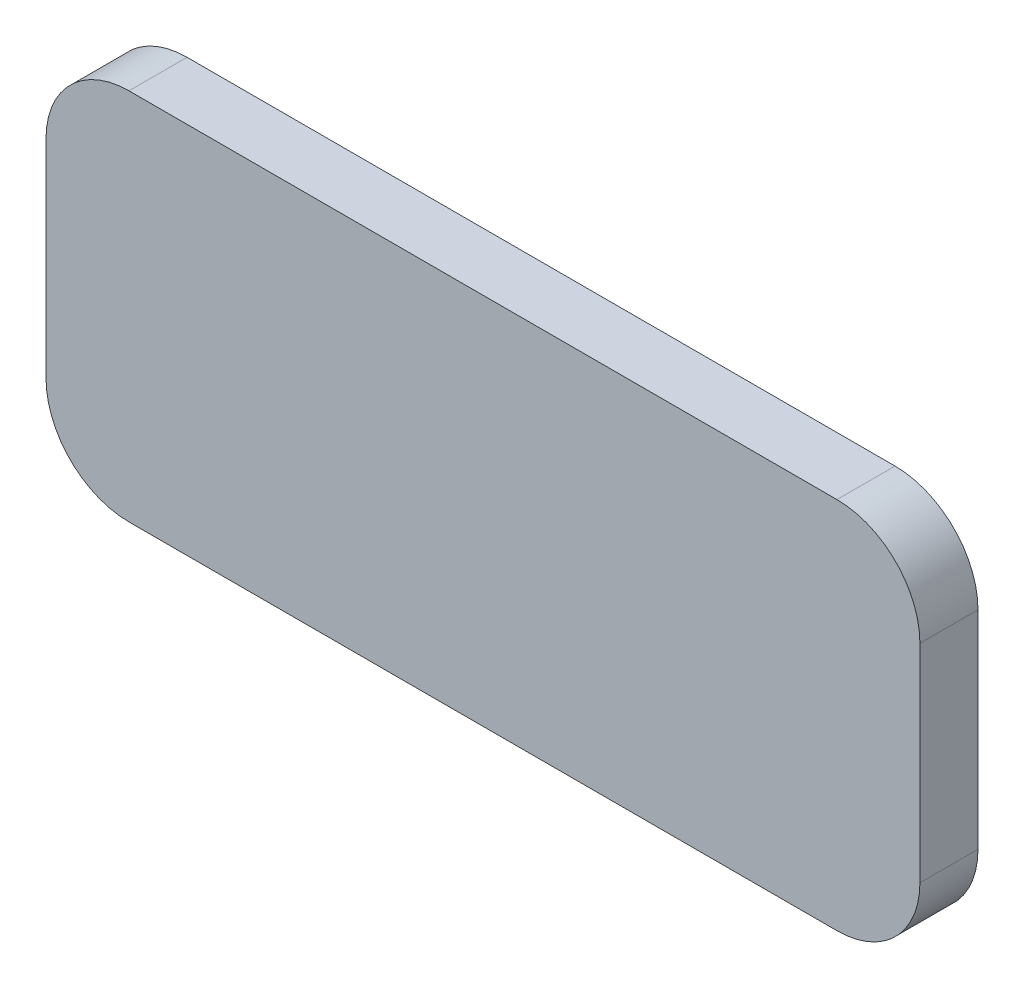
from build123d import *

# Parameters (mm, degrees)
SKETCH1_R           = 18.55
SKETCH1_R_2         = 5.175
SKETCH1_R_3         = 9
SKETCH1_R_4         = 3.25
SKETCH1_R_5         = 8.09
SKETCH1_R_6         = 5.05
BOSS_EXTRUDE1_DEPTH = 5
BOSS_EXTRUDE2_DEPTH = 2
CUT_EXTRUDE1_DEPTH  = 1
CUT_EXTRUDE2_DEPTH  = 1


with BuildPart() as part:
    # Sketch1 → Boss-Extrude1 (new body)
    with BuildSketch(Plane.XY):
        with BuildLine():
            Line((10, 0), (95.325366568, 0))
            ThreePointArc((95.325366568, 0), (102.39643438, -2.928932188), (105.325366568, -10))
            Line((105.325366568, -10), (105.325366568, -35))
            ThreePointArc((105.325366568, -35), (102.39643438, -42.071067812), (95.325366568, -45))
            Line((95.325366568, -45), (10, -45))
            ThreePointArc((10, -45), (2.928932188, -42.071067812), (0, -35))
            Line((0, -35), (0, -10))
            ThreePointArc((0, -10), (2.928932188, -2.928932188), (10, 0))
        make_face()
        with Locations((21.526352291, -22.1990508)):
            Circle(SKETCH1_R, mode=Mode.SUBTRACT)
        with Locations((71.306041965, -32.962226946)):
            Circle(SKETCH1_R_2, mode=Mode.SUBTRACT)
        with Locations((84.567812573, -11.628074229)):
            Circle(SKETCH1_R_3, mode=Mode.SUBTRACT)
        with Locations((51.50948584, -32.962226946)):
            Circle(SKETCH1_R_4, mode=Mode.SUBTRACT)
        with Locations((59.966267097, -11.628074229)):
            Circle(SKETCH1_R_5, mode=Mode.SUBTRACT)
        with Locations((94.754389996, -32.962226946)):
            Circle(SKETCH1_R_6, mode=Mode.SUBTRACT)
    extrude(amount=BOSS_EXTRUDE1_DEPTH)

    # Sketch2 → Boss-Extrude2 (add)
    with BuildSketch(Plane.XY.offset(5)):
        with BuildLine():
            Line((10, 0), (95.325366568, 0))
            ThreePointArc((95.325366568, 0), (102.39643438, -2.928932188), (105.325366568, -10))
            Line((105.325366568, -10), (105.325366568, -35))
            ThreePointArc((105.325366568, -35), (102.39643438, -42.071067812), (95.325366568, -45))
            Line((95.325366568, -45), (10, -45))
            ThreePointArc((10, -45), (2.928932188, -42.071067812), (0, -35))
            Line((0, -35), (0, -10))
            ThreePointArc((0, -10), (2.928932188, -2.928932188), (10, 0))
        make_face()
    extrude(amount=BOSS_EXTRUDE2_DEPTH)

    # Sketch3 → Cut-Extrude1 (cut)
    # profile 1 of 11: a face of its own
    with BuildSketch(Plane(origin=(0, 0, 5), x_dir=(-1, 0, 0), z_dir=(0, 0, -1))):
        with BuildLine():
            Line((-24.608374902, -21.479445495), (-24.893310799, -21.479445495))
            add(Edge.make_bspline(
                [(-24.893310799, -21.479445495), (-24.885591421, -21.447484599), (-24.870500668, -21.385003661), (-24.839025013, -21.295734218), (-24.804735688, -21.21125788), (-24.763561286, -21.133156442), (-24.718649773, -21.059860295), (-24.667194162, -20.993031875), (-24.611568413, -20.930971542), (-24.550041495, -20.875895962), (-24.485517638, -20.826023308), (-24.417087661, -20.783500934), (-24.346128322, -20.746921167), (-24.27214798, -20.716785671), (-24.194926381, -20.694083946), (-24.115161652, -20.677613129), (-24.032644762, -20.666916904), (-23.976630877, -20.665872998), (-23.948188604, -20.665342931)],
                knots=[0, 0, 0, 0, 1.162005537, 2.271625781, 3.343758855, 4.383309926, 5.390229558, 6.379919256, 7.361854164, 8.333198761, 9.295911338, 10.242430842, 11.177959212, 12.116337295, 13.062827104, 14.020064771, 14.994644689, 16, 16, 16, 16], degree=3))
            add(Edge.make_bspline(
                [(-23.948188604, -20.665342931), (-23.906747831, -20.66659409), (-23.824770228, -20.669069117), (-23.704335178, -20.69167007), (-23.588196564, -20.727434297), (-23.477625603, -20.776849749), (-23.374920311, -20.837798241), (-23.283538199, -20.91033768), (-23.204717907, -20.993068475), (-23.138592293, -21.084447302), (-23.086817115, -21.182106228), (-23.048638762, -21.282617799), (-23.025396237, -21.385743587), (-23.022384017, -21.455373405), (-23.020874902, -21.490257795)],
                knots=[0, 0, 0, 0, 1.083050992, 2.142477498, 3.193116406, 4.255571735, 5.30263384, 6.308962982, 7.297363603, 8.282367274, 9.249857812, 10.179914175, 11.08814088, 12, 12, 12, 12], degree=3))
            add(Edge.make_bspline(
                [(-23.020874902, -21.490257795), (-23.021930445, -21.523828245), (-23.02399598, -21.589520405), (-23.041534413, -21.685424906), (-23.071049451, -21.775814072), (-23.111934164, -21.861068412), (-23.164858285, -21.940647373), (-23.228968517, -22.014730003), (-23.30471736, -22.083644882), (-23.362120397, -22.123123261), (-23.391673179, -22.143447899)],
                knots=[0, 0, 0, 0, 1.024540389, 2.004866551, 2.965041327, 3.920577974, 4.882998113, 5.874504559, 6.905732034, 8, 8, 8, 8], degree=3))
            add(Edge.make_bspline(
                [(-23.391673179, -22.143447899), (-23.357898659, -22.159756669), (-23.290981566, -22.192069059), (-23.199767871, -22.255438211), (-23.116965799, -22.32860504), (-23.070788854, -22.385703018), (-23.047587642, -22.414391409)],
                knots=[0, 0, 0, 0, 1.015518401, 2.012035669, 3.001164323, 4, 4, 4, 4], degree=3))
            add(Edge.make_bspline(
                [(-23.047587642, -22.414391409), (-23.032310139, -22.435308084), (-23.002005312, -22.476798908), (-22.964598792, -22.543506951), (-22.930663381, -22.610954374), (-22.904219968, -22.680948978), (-22.883742246, -22.752679497), (-22.869104559, -22.8262691), (-22.860011232, -22.901777877), (-22.858708981, -22.952861341), (-22.858054389, -22.978539045)],
                knots=[0, 0, 0, 0, 1.025084078, 2.033381695, 3.024893161, 4.013698104, 4.991890475, 5.976764909, 6.982997093, 8, 8, 8, 8], degree=3))
            add(Edge.make_bspline(
                [(-22.858054389, -22.978539045), (-22.859682269, -23.022997864), (-22.862930369, -23.111706277), (-22.891962636, -23.242765489), (-22.936968933, -23.370877194), (-23.000883439, -23.49340937), (-23.078777537, -23.60805443), (-23.171448823, -23.710630796), (-23.277844351, -23.798803815), (-23.396503761, -23.872473094), (-23.525061442, -23.931362923), (-23.662562158, -23.972236461), (-23.807024706, -23.998857475), (-23.906091326, -24.001712134), (-23.956456833, -24.003163444)],
                knots=[0, 0, 0, 0, 0.955779014, 1.907060117, 2.875433937, 3.871313158, 4.872415639, 5.851225146, 6.836215519, 7.83643374, 8.849228613, 9.86973379, 10.916971861, 12, 12, 12, 12], degree=3))
            add(Edge.make_bspline(
                [(-23.956456833, -24.003163444), (-23.990401484, -24.002375851), (-24.057193238, -24.000826129), (-24.155385554, -23.99023197), (-24.249113096, -23.970882608), (-24.338502588, -23.944844609), (-24.423633443, -23.911832101), (-24.504245881, -23.870721567), (-24.580835856, -23.822360419), (-24.652680619, -23.766177807), (-24.719771605, -23.703329735), (-24.780325862, -23.63270049), (-24.83535296, -23.555595702), (-24.883379496, -23.471119787), (-24.926593018, -23.380364446), (-24.962135743, -23.282167594), (-24.99341908, -23.177407089), (-25.007963723, -23.104402281), (-25.015426184, -23.066945495)],
                knots=[0, 0, 0, 0, 1.048658725, 2.063410685, 3.046034179, 4.001477787, 4.936774919, 5.862367409, 6.792675028, 7.730719943, 8.675894397, 9.627829632, 10.600096036, 11.597688215, 12.626045268, 13.701542398, 14.82072376, 16, 16, 16, 16], degree=3))
            Line((-25.015426184, -23.066945495), (-24.730490287, -23.066945495))
            add(Edge.make_bspline(
                [(-24.730490287, -23.066945495), (-24.723066872, -23.0913921), (-24.708627686, -23.13894287), (-24.684049288, -23.207378005), (-24.656047355, -23.270114239), (-24.62600772, -23.327611785), (-24.594458701, -23.380436893), (-24.559157304, -23.427192731), (-24.522718151, -23.469932951), (-24.495250452, -23.494012706), (-24.481807394, -23.505797659)],
                knots=[0, 0, 0, 0, 1.198163088, 2.33053128, 3.407730985, 4.417276592, 5.372219308, 6.28897303, 7.162600585, 8, 8, 8, 8], degree=3))
            add(Edge.make_bspline(
                [(-24.481807394, -23.505797659), (-24.4640305, -23.519503076), (-24.428531584, -23.546871605), (-24.370684689, -23.581798082), (-24.309847256, -23.612061298), (-24.244701087, -23.635178651), (-24.176651974, -23.654752671), (-24.104600007, -23.667562), (-24.02918086, -23.676350555), (-23.977684389, -23.6771261), (-23.951368692, -23.677522419)],
                knots=[0, 0, 0, 0, 0.946170439, 1.889420265, 2.845303464, 3.807233317, 4.801018734, 5.828864929, 6.890507805, 8, 8, 8, 8], degree=3))
            add(Edge.make_bspline(
                [(-23.951368692, -23.677522419), (-23.921656586, -23.676963704), (-23.863557128, -23.675871187), (-23.77878022, -23.665823939), (-23.698128464, -23.65119135), (-23.62249731, -23.628591715), (-23.550896064, -23.600669086), (-23.484328424, -23.565609461), (-23.421920528, -23.52447532), (-23.36447171, -23.477721941), (-23.312814, -23.426539585), (-23.267330299, -23.373006299), (-23.228663641, -23.317347796), (-23.197472824, -23.259256072), (-23.172843396, -23.198971686), (-23.156076493, -23.136325462), (-23.144418333, -23.071830085), (-23.143468906, -23.027988806), (-23.142990287, -23.005887803)],
                knots=[0, 0, 0, 0, 1.217147791, 2.380027433, 3.494444702, 4.572153297, 5.609568379, 6.639424714, 7.649109417, 8.668170816, 9.669597737, 10.625200337, 11.543417969, 12.441394052, 13.322311151, 14.205496177, 15.095365482, 16, 16, 16, 16], degree=3))
            add(Edge.make_bspline(
                [(-23.142990287, -23.005887803), (-23.144378489, -22.97630466), (-23.147147985, -22.917285575), (-23.168292197, -22.830456062), (-23.203071024, -22.746796252), (-23.251759659, -22.667733499), (-23.311028498, -22.594458217), (-23.380302378, -22.529079087), (-23.460156557, -22.475131218), (-23.533653152, -22.437857937), (-23.598754401, -22.412424305), (-23.654466929, -22.395483444), (-23.71683899, -22.381138199), (-23.785116321, -22.367792067), (-23.859813382, -22.356433416), (-23.94084885, -22.346961197), (-24.028239148, -22.339381981), (-24.088737563, -22.335997345), (-24.119913364, -22.334253188)],
                knots=[0, 0, 0, 0, 1.07054697, 2.135767047, 3.216561865, 4.33974944, 5.486079747, 6.621378074, 7.775625952, 8.963672916, 9.598146892, 10.304877434, 11.070270905, 11.915000392, 12.823868403, 13.805723172, 14.86925407, 16, 16, 16, 16], degree=3))
            Line((-24.119913364, -22.334253188), (-24.119913364, -22.008612162))
            add(Edge.make_bspline(
                [(-24.119913364, -22.008612162), (-24.08063302, -22.00794559), (-24.003692477, -22.006639939), (-23.891302644, -21.990848387), (-23.783830425, -21.969003817), (-23.683657595, -21.935543679), (-23.592354833, -21.896681409), (-23.51314348, -21.851458334), (-23.447133282, -21.80118924), (-23.394645024, -21.74509823), (-23.355157796, -21.684941008), (-23.326286344, -21.622242326), (-23.309231762, -21.556452642), (-23.306955135, -21.511553908), (-23.305810799, -21.48898576)],
                knots=[0, 0, 0, 0, 1.321986639, 2.589447074, 3.816329219, 5.01088745, 6.139805852, 7.153945165, 8.075214402, 8.924034688, 9.728124013, 10.488707548, 11.240355623, 12, 12, 12, 12], degree=3))
            add(Edge.make_bspline(
                [(-23.305810799, -21.48898576), (-23.306186729, -21.472405234), (-23.306934624, -21.439419064), (-23.31636644, -21.391227037), (-23.330539678, -21.344508322), (-23.350024861, -21.299461594), (-23.376105398, -21.256399274), (-23.407316543, -21.214954231), (-23.444480462, -21.175363089), (-23.487066689, -21.138460228), (-23.532797398, -21.103290991), (-23.582916837, -21.07343362), (-23.635913823, -21.047902028), (-23.691847032, -21.026847694), (-23.750897977, -21.011009626), (-23.812789211, -20.999637827), (-23.877638753, -20.992527954), (-23.921881681, -20.99150432), (-23.944372498, -20.990983957)],
                knots=[0, 0, 0, 0, 0.884392785, 1.759457502, 2.611959086, 3.489218968, 4.37281399, 5.2945488, 6.255912374, 7.266815255, 8.301784654, 9.332968512, 10.37626691, 11.440494194, 12.520033166, 13.637162961, 14.798855837, 16, 16, 16, 16], degree=3))
            add(Edge.make_bspline(
                [(-23.944372498, -20.990983957), (-23.980523654, -20.992246121), (-24.05113527, -20.994711421), (-24.15293023, -21.016304155), (-24.247562769, -21.050755702), (-24.319897131, -21.091879227), (-24.373312037, -21.132474263), (-24.411481831, -21.167927571), (-24.448965437, -21.207327347), (-24.483296872, -21.253100301), (-24.518016837, -21.302146604), (-24.549625832, -21.356959515), (-24.58034141, -21.416109215), (-24.598849437, -21.457924541), (-24.608374902, -21.479445495)],
                knots=[0, 0, 0, 0, 1.472543308, 2.876219568, 4.221790263, 5.565193594, 6.249813518, 6.953379497, 7.687249741, 8.463570142, 9.283606569, 10.136032583, 11.040678096, 12, 12, 12, 12], degree=3))
        make_face()
    # profile 2 of 11: a face of its own
    with BuildSketch(Plane(origin=(0, 0, 5), x_dir=(-1, 0, 0), z_dir=(0, 0, -1))):
        Polygon((-22.369592851, -20.746753188), (-20.415746697, -20.746753188), (-22.084656953, -24.003163444), (-22.330795775, -23.867691689), (-20.898484077, -21.072394213), (-22.369592851, -21.072394213), align=None)
    # profile 3 of 11: a face of its own
    with BuildSketch(Plane(origin=(0, 0, 5), x_dir=(-1, 0, 0), z_dir=(0, 0, -1))):
        with BuildLine():
            add(Edge.make_bspline(
                [(-19.621996697, -23.433291649), (-19.60431629, -23.434342272), (-19.56965592, -23.436401895), (-19.519546139, -23.450532163), (-19.474193841, -23.475622519), (-19.433796733, -23.509062326), (-19.400498715, -23.549607677), (-19.374514195, -23.594598251), (-19.360507016, -23.645127553), (-19.358462396, -23.679988758), (-19.357413364, -23.697874983)],
                knots=[0, 0, 0, 0, 1.020151414, 1.999887582, 2.974338812, 3.990962822, 5.007586832, 5.987933904, 6.967670073, 8, 8, 8, 8], degree=3))
            add(Edge.make_bspline(
                [(-19.357413364, -23.697874983), (-19.358497944, -23.715331432), (-19.360636721, -23.749755293), (-19.374482087, -23.799903477), (-19.400696747, -23.844922169), (-19.433567062, -23.88601768), (-19.474203827, -23.919528327), (-19.519653359, -23.944405218), (-19.569538286, -23.959547229), (-19.604296665, -23.961476084), (-19.621996697, -23.962458316)],
                knots=[0, 0, 0, 0, 1.009421747, 1.99056486, 2.972319754, 3.999869655, 5.017953583, 5.993804169, 6.978383603, 8, 8, 8, 8], degree=3))
            add(Edge.make_bspline(
                [(-19.621996697, -23.962458316), (-19.639709483, -23.961511624), (-19.674289481, -23.959663434), (-19.723988204, -23.944094317), (-19.769714525, -23.919761607), (-19.810343378, -23.885955196), (-19.843488992, -23.845133637), (-19.86854916, -23.799593436), (-19.883598795, -23.749898846), (-19.885578066, -23.715359706), (-19.88658003, -23.697874983)],
                knots=[0, 0, 0, 0, 1.022052826, 1.995314843, 2.982371812, 4.00089066, 5.028879526, 6.005146991, 6.990147033, 8, 8, 8, 8], degree=3))
            add(Edge.make_bspline(
                [(-19.88658003, -23.697874983), (-19.885616554, -23.679959474), (-19.883735486, -23.644981642), (-19.868517566, -23.594908166), (-19.843683431, -23.549398225), (-19.810114251, -23.509124184), (-19.769724354, -23.475389988), (-19.724098511, -23.450838354), (-19.674169785, -23.436287409), (-19.639689341, -23.434307554), (-19.621996697, -23.433291649)],
                knots=[0, 0, 0, 0, 1.032775665, 2.016367738, 2.991239715, 4.008302682, 5.025365648, 6.011011707, 6.979408107, 8, 8, 8, 8], degree=3))
        make_face()
    # profile 4 of 11: a face of its own
    with BuildSketch(Plane(origin=(0, 0, 5), x_dir=(-1, 0, 0), z_dir=(0, 0, -1))):
        Polygon((-18.275547378, -20.746753188), (-17.688503107, -20.746753188), (-17.688503107, -23.921753188), (-17.973439005, -23.921753188), (-17.973439005, -21.072394213), (-18.461900543, -21.072394213), align=None)
    # profile 5 of 11: a face of its own
    with BuildSketch(Plane(origin=(0, 0, 5), x_dir=(-1, 0, 0), z_dir=(0, 0, -1))):
        Polygon((-65.513638589, -10.701311113), (-64.926594319, -10.701311113), (-64.926594319, -13.876311113), (-65.211530216, -13.876311113), (-65.211530216, -11.026952138), (-65.699991754, -11.026952138), align=None)
    # profile 6 of 11: a face of its own
    with BuildSketch(Plane(origin=(0, 0, 5), x_dir=(-1, 0, 0), z_dir=(0, 0, -1))):
        with BuildLine():
            Line((-62.280760985, -10.619900856), (-62.060698886, -10.792261633))
            Line((-62.060698886, -10.792261633), (-62.899606138, -12.07510919))
            add(Edge.make_bspline(
                [(-62.899606138, -12.07510919), (-62.843753101, -12.066206616), (-62.734805437, -12.04884114), (-62.6245278, -12.045976432), (-62.570785024, -12.044580343)],
                knots=[0, 0, 0, 0, 1.025318673, 2, 2, 2, 2], degree=3))
            add(Edge.make_bspline(
                [(-62.570785024, -12.044580343), (-62.538514064, -12.045435112), (-62.475199748, -12.047112132), (-62.382168226, -12.060365108), (-62.292753519, -12.080993292), (-62.2071551, -12.111183892), (-62.125264332, -12.149737493), (-62.046612948, -12.195946897), (-61.972678961, -12.25219475), (-61.902510397, -12.315028003), (-61.838804385, -12.384621256), (-61.782401821, -12.4584639), (-61.73502466, -12.536478984), (-61.69658546, -12.618626999), (-61.666736034, -12.704781313), (-61.644975813, -12.794831696), (-61.632112897, -12.888840246), (-61.630366202, -12.952774019), (-61.629478934, -12.985250416)],
                knots=[0, 0, 0, 0, 1.044136307, 2.048553127, 3.035567123, 4.010001674, 4.980053131, 5.96154148, 6.956538004, 7.981742224, 9.006487041, 10.005615874, 10.984750588, 11.954802044, 12.935714515, 13.930994945, 14.949008866, 16, 16, 16, 16], degree=3))
            add(Edge.make_bspline(
                [(-61.629478934, -12.985250416), (-61.630769893, -13.029682004), (-61.633310196, -13.117112855), (-61.658622925, -13.244454582), (-61.697956317, -13.365769078), (-61.75417879, -13.479119455), (-61.824012808, -13.584350357), (-61.909173196, -13.677591458), (-62.006639789, -13.760749278), (-62.11684567, -13.830287782), (-62.235448216, -13.887077693), (-62.3600461, -13.927867591), (-62.489429297, -13.952980453), (-62.577244905, -13.956128785), (-62.621666434, -13.957721369)],
                knots=[0, 0, 0, 0, 1.031375318, 2.029502543, 3.004789286, 3.987476834, 4.960371455, 5.9300674, 6.912260825, 7.929083631, 8.949397511, 9.960523116, 10.96833055, 12, 12, 12, 12], degree=3))
            add(Edge.make_bspline(
                [(-62.621666434, -13.957721369), (-62.66438987, -13.956335068), (-62.749017515, -13.953589049), (-62.873507264, -13.929127091), (-62.993125859, -13.889478505), (-63.107035226, -13.834855552), (-63.212554639, -13.765860187), (-63.306957037, -13.682800119), (-63.389771719, -13.587450819), (-63.458691553, -13.479827075), (-63.513354832, -13.364175471), (-63.554348549, -13.243582479), (-63.578293713, -13.118487496), (-63.581639761, -13.033686748), (-63.583325088, -12.990974574)],
                knots=[0, 0, 0, 0, 1.012016664, 2.004627821, 2.994792927, 3.992885782, 4.990978636, 5.973936114, 6.964471063, 7.975201453, 8.993600317, 9.990122807, 10.98767138, 12, 12, 12, 12], degree=3))
            add(Edge.make_bspline(
                [(-63.583325088, -12.990974574), (-63.582253348, -12.958276988), (-63.580065061, -12.891514764), (-63.5647857, -12.790400968), (-63.540234065, -12.686940343), (-63.512738341, -12.599170468), (-63.483686538, -12.527268944), (-63.459508877, -12.469299349), (-63.429415324, -12.409644661), (-63.397326613, -12.346259292), (-63.360354311, -12.280776792), (-63.320153686, -12.212102749), (-63.275613289, -12.141329343), (-63.244389284, -12.093301395), (-63.228427251, -12.068749013)],
                knots=[0, 0, 0, 0, 1.173818275, 2.396712641, 3.66331629, 4.989737886, 5.693666774, 6.447286557, 7.243889047, 8.091586357, 8.998013824, 9.943181721, 10.948533338, 12, 12, 12, 12], degree=3))
            Line((-63.228427251, -12.068749013), (-62.280760985, -10.619900856))
        make_face()
        with BuildLine():
            add(Edge.make_bspline(
                [(-62.630570681, -12.370221369), (-62.654756372, -12.370936532), (-62.7022085, -12.372339675), (-62.771740055, -12.380264229), (-62.83736854, -12.395280345), (-62.899847882, -12.414700028), (-62.95851119, -12.441156066), (-63.014085704, -12.472857914), (-63.065931793, -12.510839511), (-63.113796371, -12.553716447), (-63.157170701, -12.600703996), (-63.194529155, -12.651020588), (-63.226752714, -12.703466897), (-63.252952737, -12.758477652), (-63.273354425, -12.816032731), (-63.288112059, -12.875867182), (-63.296325103, -12.938382306), (-63.29769147, -12.980775361), (-63.29838919, -13.002422891)],
                knots=[0, 0, 0, 0, 1.128956033, 2.215002439, 3.259141796, 4.2666399, 5.263148119, 6.255916712, 7.247353359, 8.256307737, 9.250603402, 10.226115518, 11.176314381, 12.118911324, 13.063945463, 14.021379252, 14.989639887, 16, 16, 16, 16], degree=3))
            add(Edge.make_bspline(
                [(-63.29838919, -13.002422891), (-63.297820991, -13.023876802), (-63.296706837, -13.065944726), (-63.286590089, -13.127938125), (-63.271136836, -13.187596292), (-63.248149477, -13.24461167), (-63.220729371, -13.29985333), (-63.184529542, -13.351320339), (-63.1444186, -13.402138546), (-63.096472532, -13.448404166), (-63.045016338, -13.491454104), (-62.99004239, -13.52908262), (-62.932747284, -13.561273648), (-62.872357494, -13.586502287), (-62.809729817, -13.607207176), (-62.744342457, -13.621777232), (-62.676149938, -13.630014566), (-62.629956466, -13.631382713), (-62.606402011, -13.632080343)],
                knots=[0, 0, 0, 0, 0.989467248, 1.94019797, 2.891935182, 3.827694429, 4.772920941, 5.730924762, 6.725747692, 7.756678648, 8.79901574, 9.819492441, 10.826891316, 11.826466727, 12.835195252, 13.867842842, 14.912794438, 16, 16, 16, 16], degree=3))
            add(Edge.make_bspline(
                [(-62.606402011, -13.632080343), (-62.582847594, -13.631382659), (-62.536654198, -13.630014404), (-62.46846113, -13.621777848), (-62.403075798, -13.607204917), (-62.340440751, -13.586510475), (-62.280078167, -13.561243272), (-62.22283317, -13.529282888), (-62.168379114, -13.491222695), (-62.116889141, -13.448477736), (-62.06914264, -13.40187522), (-62.02806968, -13.351773972), (-61.992978461, -13.299437367), (-61.964463163, -13.244829281), (-61.941728992, -13.187561817), (-61.926197375, -13.12794736), (-61.91610152, -13.065942308), (-61.914984495, -13.023875985), (-61.914414831, -13.002422891)],
                knots=[0, 0, 0, 0, 1.087397944, 2.132534446, 3.165364764, 4.174271784, 5.174024072, 6.181601208, 7.194203697, 8.236725232, 9.267838612, 10.269026844, 11.221737037, 12.171628256, 13.107553087, 14.05945871, 15.010357665, 16, 16, 16, 16], degree=3))
            add(Edge.make_bspline(
                [(-61.914414831, -13.002422891), (-61.914914026, -12.980747121), (-61.915893784, -12.938204634), (-61.926975385, -12.875895137), (-61.942344572, -12.815728753), (-61.96555191, -12.758083303), (-61.995702681, -12.703187457), (-62.032425077, -12.650759343), (-62.074916115, -12.600414809), (-62.123962226, -12.553596012), (-62.177352668, -12.511103868), (-62.233759834, -12.472715325), (-62.293534781, -12.441451158), (-62.355599009, -12.414610043), (-62.420700063, -12.395588171), (-62.488126859, -12.380217346), (-62.558518306, -12.372405922), (-62.606387143, -12.370954589), (-62.630570681, -12.370221369)],
                knots=[0, 0, 0, 0, 0.978753431, 1.920974676, 2.853199117, 3.782215702, 4.721507756, 5.67862441, 6.671401678, 7.694929396, 8.738190014, 9.75360867, 10.774035531, 11.783329636, 12.805060902, 13.835252836, 14.906360638, 16, 16, 16, 16], degree=3))
        make_face(mode=Mode.SUBTRACT)
    # profile 7 of 11: a face of its own
    with BuildSketch(Plane(origin=(0, 0, 5), x_dir=(-1, 0, 0), z_dir=(0, 0, -1))):
        with BuildLine():
            add(Edge.make_bspline(
                [(-60.795023806, -13.387849574), (-60.777343399, -13.388900197), (-60.742683029, -13.39095982), (-60.692573248, -13.405090088), (-60.647220949, -13.430180444), (-60.606823842, -13.46362025), (-60.573525824, -13.504165602), (-60.547541304, -13.549156176), (-60.533534125, -13.599685478), (-60.531489505, -13.634546683), (-60.530440472, -13.652432908)],
                knots=[0, 0, 0, 0, 1.020151414, 1.999887582, 2.974338812, 3.990962822, 5.007586832, 5.987933904, 6.967670073, 8, 8, 8, 8], degree=3))
            add(Edge.make_bspline(
                [(-60.530440472, -13.652432908), (-60.531525053, -13.669889357), (-60.53366383, -13.704313218), (-60.547509196, -13.754461402), (-60.573723856, -13.799480094), (-60.606594171, -13.840575605), (-60.647230936, -13.874086252), (-60.692680468, -13.898963143), (-60.742565395, -13.914105153), (-60.777323774, -13.916034009), (-60.795023806, -13.917016241)],
                knots=[0, 0, 0, 0, 1.009421747, 1.99056486, 2.972319754, 3.999869655, 5.017953583, 5.993804169, 6.978383603, 8, 8, 8, 8], degree=3))
            add(Edge.make_bspline(
                [(-60.795023806, -13.917016241), (-60.812736592, -13.916069549), (-60.847316589, -13.914221359), (-60.897015313, -13.898652242), (-60.942741634, -13.874319531), (-60.983370487, -13.840513121), (-61.016516101, -13.799691562), (-61.041576269, -13.754151361), (-61.056625904, -13.704456771), (-61.058605175, -13.669917631), (-61.059607139, -13.652432908)],
                knots=[0, 0, 0, 0, 1.022052826, 1.995314843, 2.982371812, 4.00089066, 5.028879526, 6.005146991, 6.990147033, 8, 8, 8, 8], degree=3))
            add(Edge.make_bspline(
                [(-61.059607139, -13.652432908), (-61.058643663, -13.634517399), (-61.056762595, -13.599539567), (-61.041544675, -13.549466091), (-61.01671054, -13.503956149), (-60.98314136, -13.463682109), (-60.942751463, -13.429947913), (-60.89712562, -13.405396279), (-60.847196894, -13.390845334), (-60.81271645, -13.388865479), (-60.795023806, -13.387849574)],
                knots=[0, 0, 0, 0, 1.032775665, 2.016367738, 2.991239715, 4.008302682, 5.025365648, 6.011011707, 6.979408107, 8, 8, 8, 8], degree=3))
        make_face()
    # profile 8 of 11: a face of its own
    with BuildSketch(Plane(origin=(0, 0, 5), x_dir=(-1, 0, 0), z_dir=(0, 0, -1))):
        Polygon((-59.448574487, -10.701311113), (-58.861530216, -10.701311113), (-58.861530216, -13.876311113), (-59.146466113, -13.876311113), (-59.146466113, -11.026952138), (-59.634927652, -11.026952138), align=None)
    # profile 9 of 11: a face of its own
    with BuildSketch(Plane(origin=(0, 0, 5), x_dir=(-1, 0, 0), z_dir=(0, 0, -1))):
        with BuildLine():
            add(Edge.make_bspline(
                [(-56.137466714, -12.107546089), (-56.11147839, -12.121096949), (-56.060792477, -12.147525651), (-55.988604581, -12.190080474), (-55.922632615, -12.234930492), (-55.861046177, -12.279957307), (-55.80492728, -12.326885305), (-55.75490342, -12.375901097), (-55.709738936, -12.425781204), (-55.670344639, -12.477370274), (-55.635694652, -12.530531248), (-55.605747929, -12.58540366), (-55.580150895, -12.641867256), (-55.559864515, -12.70053838), (-55.543153318, -12.760555189), (-55.531654734, -12.822692644), (-55.525470815, -12.886541296), (-55.524301677, -12.929692541), (-55.523709703, -12.951541481)],
                knots=[0, 0, 0, 0, 1.272397273, 2.481599622, 3.635517121, 4.734568067, 5.792894095, 6.808321871, 7.773003508, 8.711915296, 9.623354172, 10.525449501, 11.423591555, 12.311487226, 13.218079475, 14.126165749, 15.051214107, 16, 16, 16, 16], degree=3))
            add(Edge.make_bspline(
                [(-55.523709703, -12.951541481), (-55.524409492, -12.982110139), (-55.525794636, -13.042616982), (-55.537859622, -13.131921668), (-55.555923538, -13.218655214), (-55.58230281, -13.302798602), (-55.616514243, -13.383887533), (-55.658675373, -13.46199142), (-55.706401252, -13.538390365), (-55.744730069, -13.585397965), (-55.764124367, -13.609183709)],
                knots=[0, 0, 0, 0, 1.025265484, 2.029385089, 3.018602448, 3.995076438, 4.983346944, 5.966715145, 6.97116228, 8, 8, 8, 8], degree=3))
            add(Edge.make_bspline(
                [(-55.764124367, -13.609183709), (-55.789376026, -13.636936633), (-55.839567301, -13.692099529), (-55.925548957, -13.763719193), (-56.019911666, -13.823907572), (-56.122290296, -13.872958505), (-56.232411181, -13.911136391), (-56.350250857, -13.938570675), (-56.476039053, -13.954284593), (-56.56249473, -13.956556069), (-56.606847724, -13.957721369)],
                knots=[0, 0, 0, 0, 0.954267603, 1.896743057, 2.838368354, 3.796610408, 4.779680527, 5.799409237, 6.871065594, 8, 8, 8, 8], degree=3))
            add(Edge.make_bspline(
                [(-56.606847724, -13.957721369), (-56.649495584, -13.956675907), (-56.732483987, -13.954641544), (-56.853277204, -13.940858024), (-56.965874561, -13.916702745), (-57.070930746, -13.883642278), (-57.167812418, -13.840634428), (-57.256243517, -13.787105371), (-57.337499906, -13.725209706), (-57.409115635, -13.653169792), (-57.472695867, -13.576010151), (-57.528546886, -13.496406905), (-57.574969086, -13.414352787), (-57.614272951, -13.331071297), (-57.644361086, -13.245395143), (-57.665200163, -13.157765131), (-57.678434755, -13.068334323), (-57.680195641, -13.007980609), (-57.681081498, -12.977618204)],
                knots=[0, 0, 0, 0, 1.256902934, 2.445805442, 3.576955095, 4.645999104, 5.686449165, 6.692658513, 7.68621702, 8.689161843, 9.678783111, 10.630372946, 11.551080876, 12.453998257, 13.34127905, 14.221779781, 15.105423033, 16, 16, 16, 16], degree=3))
            add(Edge.make_bspline(
                [(-57.681081498, -12.977618204), (-57.680557277, -12.955339508), (-57.679521232, -12.911308942), (-57.672350406, -12.846258337), (-57.660822016, -12.782943272), (-57.645165223, -12.721129883), (-57.62394622, -12.661268186), (-57.598326571, -12.603074542), (-57.568452586, -12.546483252), (-57.533907529, -12.491184839), (-57.493719264, -12.437954138), (-57.448213667, -12.385887772), (-57.396481244, -12.33579365), (-57.33909751, -12.287059736), (-57.27671825, -12.238821531), (-57.207723204, -12.193685977), (-57.133941404, -12.14845768), (-57.081503643, -12.121417271), (-57.054604134, -12.107546089)],
                knots=[0, 0, 0, 0, 0.941657376, 1.861047343, 2.762797495, 3.66048619, 4.553285746, 5.444104102, 6.34607688, 7.256116206, 8.197091036, 9.162375105, 10.176350973, 11.237807142, 12.343728897, 13.50695164, 14.721116704, 16, 16, 16, 16], degree=3))
            add(Edge.make_bspline(
                [(-57.054604134, -12.107546089), (-57.09142631, -12.087466691), (-57.162724348, -12.048587358), (-57.257130199, -11.977152755), (-57.338220264, -11.899784523), (-57.403765615, -11.814848924), (-57.455356851, -11.724999259), (-57.490752299, -11.630797687), (-57.514697681, -11.533990927), (-57.517069703, -11.467854592), (-57.518260985, -11.434639438)],
                knots=[0, 0, 0, 0, 1.166880483, 2.259407225, 3.286803203, 4.280235371, 5.237608625, 6.161067461, 7.076446754, 8, 8, 8, 8], degree=3))
            add(Edge.make_bspline(
                [(-57.518260985, -11.434639438), (-57.516777422, -11.400805224), (-57.513795201, -11.332792554), (-57.489680332, -11.231549857), (-57.450382843, -11.132111973), (-57.396933081, -11.034960862), (-57.330360392, -10.943384596), (-57.250489597, -10.861251023), (-57.159228035, -10.789304178), (-57.057031256, -10.728910078), (-56.94705267, -10.679757759), (-56.831014835, -10.64585019), (-56.710939516, -10.623683141), (-56.629208014, -10.62117339), (-56.587767195, -10.619900856)],
                knots=[0, 0, 0, 0, 0.888701115, 1.786444228, 2.72001202, 3.692817113, 4.693886446, 5.687152267, 6.695133018, 7.739871481, 8.800368666, 9.853104506, 10.91144658, 12, 12, 12, 12], degree=3))
            add(Edge.make_bspline(
                [(-56.587767195, -10.619900856), (-56.547395877, -10.621212896), (-56.467788238, -10.623800089), (-56.350771683, -10.645378186), (-56.238807687, -10.681418536), (-56.132282356, -10.730311017), (-56.033102733, -10.790533456), (-55.945470638, -10.863468535), (-55.868061796, -10.945239798), (-55.804031667, -11.036788296), (-55.751269617, -11.1335661), (-55.714529514, -11.234823673), (-55.690987366, -11.338373176), (-55.688017957, -11.408439079), (-55.686530216, -11.443543685)],
                knots=[0, 0, 0, 0, 1.072916533, 2.115669174, 3.151510826, 4.193348718, 5.225979165, 6.227137561, 7.216255879, 8.211077061, 9.189680878, 10.138522389, 11.067357538, 12, 12, 12, 12], degree=3))
            add(Edge.make_bspline(
                [(-55.686530216, -11.443543685), (-55.687831567, -11.477993944), (-55.690387348, -11.545652295), (-55.711886579, -11.644282782), (-55.748093656, -11.736649917), (-55.797527647, -11.82380181), (-55.86195791, -11.904157882), (-55.940524404, -11.978739966), (-56.032600745, -12.048160731), (-56.101780263, -12.087336933), (-56.137466714, -12.107546089)],
                knots=[0, 0, 0, 0, 0.975232327, 1.915300861, 2.843280834, 3.77672583, 4.742871857, 5.749627742, 6.839139064, 8, 8, 8, 8], degree=3))
        make_face()
        with BuildLine():
            add(Edge.make_bspline(
                [(-56.603667636, -10.945541882), (-56.625938724, -10.946132832), (-56.669510711, -10.947288987), (-56.733399577, -10.953329322), (-56.794153081, -10.96507974), (-56.852405986, -10.980717715), (-56.907359623, -11.001843247), (-56.959760326, -11.026694434), (-57.008716277, -11.056907793), (-57.054818459, -11.090799737), (-57.096320947, -11.128076873), (-57.133155076, -11.166915032), (-57.163751294, -11.208076995), (-57.189732872, -11.250538864), (-57.208584677, -11.295560887), (-57.222703724, -11.34176274), (-57.232248129, -11.389728267), (-57.232963312, -11.422509244), (-57.233325088, -11.439091561)],
                knots=[0, 0, 0, 0, 1.203892937, 2.355340988, 3.463153438, 4.544400666, 5.610487187, 6.640501085, 7.674077295, 8.714426146, 9.728707835, 10.68524104, 11.601827946, 12.495867327, 13.368432065, 14.231010473, 15.105153427, 16, 16, 16, 16], degree=3))
            add(Edge.make_bspline(
                [(-57.233325088, -11.439091561), (-57.232701548, -11.455674595), (-57.231469343, -11.488445052), (-57.221939691, -11.536837373), (-57.207736687, -11.584391286), (-57.185375016, -11.629976041), (-57.158554105, -11.675172946), (-57.125451123, -11.718852406), (-57.086000362, -11.761166434), (-57.04152547, -11.801755127), (-56.993073575, -11.83976329), (-56.941743764, -11.872758962), (-56.888180252, -11.900367048), (-56.832933375, -11.923344437), (-56.775440069, -11.941206023), (-56.716052626, -11.953877581), (-56.654761063, -11.961753392), (-56.613231536, -11.962694118), (-56.592219319, -11.963170087)],
                knots=[0, 0, 0, 0, 0.873023192, 1.725219244, 2.590779336, 3.480155217, 4.391973325, 5.357036234, 6.360879153, 7.436073238, 8.526419356, 9.601555421, 10.645666583, 11.697338044, 12.750135903, 13.812665442, 14.89329948, 16, 16, 16, 16], degree=3))
            add(Edge.make_bspline(
                [(-56.592219319, -11.963170087), (-56.565231724, -11.962378272), (-56.511523091, -11.960802462), (-56.432348269, -11.94615104), (-56.355365727, -11.923104243), (-56.281398292, -11.891571988), (-56.212360561, -11.851995287), (-56.150819928, -11.804612478), (-56.097301318, -11.750517647), (-56.052360907, -11.690552931), (-56.01751769, -11.62673399), (-55.990392478, -11.562689439), (-55.974552661, -11.497735987), (-55.972486583, -11.454223098), (-55.971466113, -11.432731385)],
                knots=[0, 0, 0, 0, 1.076279235, 2.141928126, 3.20205304, 4.278698113, 5.344010996, 6.36967002, 7.368914609, 8.37248503, 9.349703398, 10.264243087, 11.142681841, 12, 12, 12, 12], degree=3))
            add(Edge.make_bspline(
                [(-55.971466113, -11.432731385), (-55.971948621, -11.417647381), (-55.972906328, -11.387707795), (-55.980798522, -11.343495135), (-55.993839456, -11.300288299), (-56.01149525, -11.257730353), (-56.034726992, -11.216418403), (-56.062271648, -11.175703031), (-56.09573116, -11.136500159), (-56.133283639, -11.097896197), (-56.175869831, -11.062169262), (-56.223407666, -11.030750632), (-56.275653425, -11.004069422), (-56.332608344, -10.982398909), (-56.394062668, -10.966122635), (-56.459733347, -10.953933948), (-56.530167952, -10.947064054), (-56.578636369, -10.946060277), (-56.603667636, -10.945541882)],
                knots=[0, 0, 0, 0, 0.814439003, 1.616544685, 2.417341072, 3.248991801, 4.09997495, 4.973547432, 5.9003056, 6.880240646, 7.880314356, 8.896779544, 9.951930927, 11.043077905, 12.18215768, 13.381699519, 14.647792085, 16, 16, 16, 16], degree=3))
        make_face(mode=Mode.SUBTRACT)
        with BuildLine():
            add(Edge.make_bspline(
                [(-56.585223125, -12.288811113), (-56.613458659, -12.289313344), (-56.668849887, -12.290298601), (-56.7500001, -12.301265505), (-56.827881186, -12.316532168), (-56.902230557, -12.339692286), (-56.973016816, -12.369806245), (-57.040623164, -12.406032578), (-57.104532403, -12.448854658), (-57.163862019, -12.497728445), (-57.218039611, -12.550396664), (-57.265572354, -12.606151601), (-57.305937962, -12.663957042), (-57.33844384, -12.724547135), (-57.365124483, -12.786638897), (-57.382644928, -12.851778644), (-57.39387691, -12.918714096), (-57.395385154, -12.964216471), (-57.396145601, -12.987158468)],
                knots=[0, 0, 0, 0, 1.140299081, 2.23698856, 3.303958914, 4.344563908, 5.37730929, 6.408454204, 7.439741482, 8.480804886, 9.510774543, 10.48932336, 11.43758569, 12.353841022, 13.263987381, 14.161954604, 15.073269652, 16, 16, 16, 16], degree=3))
            add(Edge.make_bspline(
                [(-57.396145601, -12.987158468), (-57.39490893, -13.01567079), (-57.392455405, -13.072238571), (-57.372991168, -13.155843643), (-57.341753218, -13.236779885), (-57.298187487, -13.314387728), (-57.244241903, -13.386913896), (-57.17790575, -13.450131571), (-57.103301561, -13.506303198), (-57.017905079, -13.551733396), (-56.924624971, -13.588014443), (-56.823486045, -13.613011638), (-56.715939798, -13.629559239), (-56.641681453, -13.631226732), (-56.603667636, -13.632080343)],
                knots=[0, 0, 0, 0, 0.898778495, 1.783155532, 2.693654817, 3.627872908, 4.583023416, 5.533784346, 6.509005473, 7.520592997, 8.575161974, 9.658835044, 10.801527049, 12, 12, 12, 12], degree=3))
            add(Edge.make_bspline(
                [(-56.603667636, -13.632080343), (-56.573958374, -13.631509924), (-56.516075204, -13.630398565), (-56.43163295, -13.620588455), (-56.351945395, -13.605031296), (-56.277167071, -13.582403936), (-56.206460873, -13.554781458), (-56.141025616, -13.519246784), (-56.079177953, -13.478831462), (-56.023965498, -13.430881563), (-55.973679659, -13.379646593), (-55.929834458, -13.325408482), (-55.891772965, -13.269641301), (-55.861899884, -13.21108479), (-55.838018211, -13.150862375), (-55.820851843, -13.088418732), (-55.810259848, -13.023562343), (-55.809188607, -12.979566757), (-55.808645601, -12.95726564)],
                knots=[0, 0, 0, 0, 1.224942928, 2.386581632, 3.501229538, 4.569074225, 5.605009692, 6.626002462, 7.634866581, 8.645888296, 9.63523824, 10.59253846, 11.518950513, 12.414518923, 13.29783783, 14.186679152, 15.080837789, 16, 16, 16, 16], degree=3))
            add(Edge.make_bspline(
                [(-55.808645601, -12.95726564), (-55.809467335, -12.935605481), (-55.811087651, -12.892895431), (-55.821371649, -12.829607225), (-55.839438195, -12.768463243), (-55.864228048, -12.708727881), (-55.897230778, -12.65161149), (-55.936097196, -12.595626106), (-55.982991146, -12.542325617), (-56.035979716, -12.491296023), (-56.093727487, -12.444110319), (-56.155111254, -12.402368649), (-56.219658516, -12.367214944), (-56.287232686, -12.33862498), (-56.357683719, -12.316139204), (-56.430959797, -12.300431123), (-56.507146711, -12.290543626), (-56.55890363, -12.289395141), (-56.585223125, -12.288811113)],
                knots=[0, 0, 0, 0, 0.917430815, 1.809013306, 2.70690318, 3.612392954, 4.541220862, 5.495268465, 6.494511384, 7.542276156, 8.608045339, 9.649016899, 10.681629292, 11.715607085, 12.752076957, 13.808767841, 14.885711793, 16, 16, 16, 16], degree=3))
        make_face(mode=Mode.SUBTRACT)
    # profile 10 of 11: a face of its own
    with BuildSketch(Plane(origin=(0, 0, 5), x_dir=(-1, 0, 0), z_dir=(0, 0, -1))):
        Polygon((-86.556530977, -10.965091256), (-85.969486706, -10.965091256), (-85.969486706, -14.140091256), (-86.254422604, -14.140091256), (-86.254422604, -11.290732282), (-86.742884142, -11.290732282), align=None)
    # profile 11 of 11: a face of its own
    with BuildSketch(Plane(origin=(0, 0, 5), x_dir=(-1, 0, 0), z_dir=(0, 0, -1))):
        with BuildLine():
            add(Edge.make_bspline(
                [(-83.245423205, -12.371326232), (-83.21943488, -12.384877092), (-83.168748967, -12.411305795), (-83.096561071, -12.453860617), (-83.030589106, -12.498710635), (-82.969002668, -12.54373745), (-82.912883771, -12.590665448), (-82.86285991, -12.63968124), (-82.817695427, -12.689561348), (-82.77830113, -12.741150417), (-82.743651142, -12.794311391), (-82.71370442, -12.849183803), (-82.688107386, -12.905647399), (-82.667821005, -12.964318523), (-82.651109809, -13.024335332), (-82.639611224, -13.086472787), (-82.633427306, -13.150321439), (-82.632258168, -13.193472684), (-82.631666194, -13.215321625)],
                knots=[0, 0, 0, 0, 1.272397273, 2.481599622, 3.635517121, 4.734568067, 5.792894095, 6.808321871, 7.773003508, 8.711915296, 9.623354172, 10.525449501, 11.423591555, 12.311487226, 13.218079475, 14.126165749, 15.051214107, 16, 16, 16, 16], degree=3))
            add(Edge.make_bspline(
                [(-82.631666194, -13.215321625), (-82.632365982, -13.245890282), (-82.633751127, -13.306397125), (-82.645816112, -13.395701812), (-82.663880028, -13.482435357), (-82.6902593, -13.566578745), (-82.724470733, -13.647667676), (-82.766631863, -13.725771564), (-82.814357742, -13.802170509), (-82.852686559, -13.849178109), (-82.872080857, -13.872963852)],
                knots=[0, 0, 0, 0, 1.025265484, 2.029385089, 3.018602448, 3.995076438, 4.983346944, 5.966715145, 6.97116228, 8, 8, 8, 8], degree=3))
            add(Edge.make_bspline(
                [(-82.872080857, -13.872963852), (-82.897332516, -13.900716776), (-82.947523792, -13.955879673), (-83.033505448, -14.027499336), (-83.127868157, -14.087687715), (-83.230246787, -14.136738648), (-83.340367672, -14.174916534), (-83.458207347, -14.202350818), (-83.583995543, -14.218064736), (-83.670451221, -14.220336213), (-83.714804214, -14.221501512)],
                knots=[0, 0, 0, 0, 0.954267603, 1.896743057, 2.838368354, 3.796610408, 4.779680527, 5.799409237, 6.871065594, 8, 8, 8, 8], degree=3))
            add(Edge.make_bspline(
                [(-83.714804214, -14.221501512), (-83.757452074, -14.22045605), (-83.840440477, -14.218421687), (-83.961233695, -14.204638167), (-84.073831051, -14.180482888), (-84.178887236, -14.147422421), (-84.275768908, -14.104414571), (-84.364200007, -14.050885514), (-84.445456396, -13.988989849), (-84.517072126, -13.916949935), (-84.580652357, -13.839790294), (-84.636503377, -13.760187048), (-84.682925577, -13.678132931), (-84.722229442, -13.59485144), (-84.752317576, -13.509175286), (-84.773156653, -13.421545274), (-84.786391245, -13.332114466), (-84.788152132, -13.271760752), (-84.789037989, -13.241398347)],
                knots=[0, 0, 0, 0, 1.256902934, 2.445805442, 3.576955095, 4.645999104, 5.686449165, 6.692658513, 7.68621702, 8.689161843, 9.678783111, 10.630372946, 11.551080876, 12.453998257, 13.34127905, 14.221779781, 15.105423033, 16, 16, 16, 16], degree=3))
            add(Edge.make_bspline(
                [(-84.789037989, -13.241398347), (-84.788513768, -13.219119652), (-84.787477723, -13.175089086), (-84.780306896, -13.110038481), (-84.768778506, -13.046723416), (-84.753121713, -12.984910027), (-84.731902711, -12.925048329), (-84.706283061, -12.866854685), (-84.676409076, -12.810263396), (-84.641864019, -12.754964982), (-84.601675755, -12.701734282), (-84.556170158, -12.649667915), (-84.504437734, -12.599573793), (-84.447054001, -12.550839879), (-84.38467474, -12.502601674), (-84.315679694, -12.45746612), (-84.241897894, -12.412237824), (-84.189460134, -12.385197414), (-84.162560625, -12.371326232)],
                knots=[0, 0, 0, 0, 0.941657376, 1.861047343, 2.762797495, 3.66048619, 4.553285746, 5.444104102, 6.34607688, 7.256116206, 8.197091036, 9.162375105, 10.176350973, 11.237807142, 12.343728897, 13.50695164, 14.721116704, 16, 16, 16, 16], degree=3))
            add(Edge.make_bspline(
                [(-84.162560625, -12.371326232), (-84.1993828, -12.351246835), (-84.270680839, -12.312367501), (-84.365086689, -12.240932899), (-84.446176755, -12.163564667), (-84.511722106, -12.078629067), (-84.563313341, -11.988779403), (-84.598708789, -11.894577831), (-84.622654171, -11.797771071), (-84.625026193, -11.731634735), (-84.626217476, -11.698419581)],
                knots=[0, 0, 0, 0, 1.166880483, 2.259407225, 3.286803203, 4.280235371, 5.237608625, 6.161067461, 7.076446754, 8, 8, 8, 8], degree=3))
            add(Edge.make_bspline(
                [(-84.626217476, -11.698419581), (-84.624733912, -11.664585368), (-84.621751691, -11.596572698), (-84.597636822, -11.49533), (-84.558339333, -11.395892116), (-84.504889572, -11.298741005), (-84.438316883, -11.207164739), (-84.358446088, -11.125031166), (-84.267184525, -11.053084321), (-84.164987746, -10.992690222), (-84.055009161, -10.943537903), (-83.938971326, -10.909630333), (-83.818896007, -10.887463285), (-83.737164504, -10.884953534), (-83.695723686, -10.883681)],
                knots=[0, 0, 0, 0, 0.888701115, 1.786444228, 2.72001202, 3.692817113, 4.693886446, 5.687152267, 6.695133018, 7.739871481, 8.800368666, 9.853104506, 10.91144658, 12, 12, 12, 12], degree=3))
            add(Edge.make_bspline(
                [(-83.695723686, -10.883681), (-83.655352368, -10.884993039), (-83.575744728, -10.887580232), (-83.458728173, -10.909158329), (-83.346764177, -10.945198679), (-83.240238846, -10.99409116), (-83.141059223, -11.054313599), (-83.053427129, -11.127248678), (-82.976018286, -11.209019942), (-82.911988157, -11.300568439), (-82.859226108, -11.397346243), (-82.822486004, -11.498603816), (-82.798943857, -11.602153319), (-82.795974448, -11.672219223), (-82.794486706, -11.707323828)],
                knots=[0, 0, 0, 0, 1.072916533, 2.115669174, 3.151510826, 4.193348718, 5.225979165, 6.227137561, 7.216255879, 8.211077061, 9.189680878, 10.138522389, 11.067357538, 12, 12, 12, 12], degree=3))
            add(Edge.make_bspline(
                [(-82.794486706, -11.707323828), (-82.795788058, -11.741774087), (-82.798343838, -11.809432439), (-82.819843069, -11.908062925), (-82.856050146, -12.00043006), (-82.905484137, -12.087581953), (-82.969914401, -12.167938026), (-83.048480894, -12.242520109), (-83.140557235, -12.311940875), (-83.209736753, -12.351117077), (-83.245423205, -12.371326232)],
                knots=[0, 0, 0, 0, 0.975232327, 1.915300861, 2.843280834, 3.77672583, 4.742871857, 5.749627742, 6.839139064, 8, 8, 8, 8], degree=3))
        make_face()
        with BuildLine():
            add(Edge.make_bspline(
                [(-83.711624126, -11.209322025), (-83.733895215, -11.209912975), (-83.777467201, -11.211069131), (-83.841356067, -11.217109466), (-83.902109572, -11.228859884), (-83.960362477, -11.244497858), (-84.015316113, -11.26562339), (-84.067716816, -11.290474577), (-84.116672767, -11.320687936), (-84.162774949, -11.35457988), (-84.204277437, -11.391857016), (-84.241111566, -11.430695176), (-84.271707784, -11.471857138), (-84.297689362, -11.514319007), (-84.316541167, -11.55934103), (-84.330660214, -11.605542883), (-84.34020462, -11.65350841), (-84.340919802, -11.686289388), (-84.341281578, -11.702871705)],
                knots=[0, 0, 0, 0, 1.203892937, 2.355340988, 3.463153438, 4.544400666, 5.610487187, 6.640501085, 7.674077295, 8.714426146, 9.728707835, 10.68524104, 11.601827946, 12.495867327, 13.368432065, 14.231010473, 15.105153427, 16, 16, 16, 16], degree=3))
            add(Edge.make_bspline(
                [(-84.341281578, -11.702871705), (-84.340658038, -11.719454738), (-84.339425834, -11.752225195), (-84.329896182, -11.800617516), (-84.315693178, -11.84817143), (-84.293331506, -11.893756185), (-84.266510596, -11.938953089), (-84.233407614, -11.982632549), (-84.193956853, -12.024946577), (-84.149481961, -12.06553527), (-84.101030065, -12.103543434), (-84.049700255, -12.136539105), (-83.996136743, -12.164147191), (-83.940889866, -12.18712458), (-83.88339656, -12.204986166), (-83.824009116, -12.217657724), (-83.762717553, -12.225533535), (-83.721188026, -12.226474262), (-83.700175809, -12.22695023)],
                knots=[0, 0, 0, 0, 0.873023192, 1.725219244, 2.590779336, 3.480155217, 4.391973325, 5.357036234, 6.360879153, 7.436073238, 8.526419356, 9.601555421, 10.645666583, 11.697338044, 12.750135903, 13.812665442, 14.89329948, 16, 16, 16, 16], degree=3))
            add(Edge.make_bspline(
                [(-83.700175809, -12.22695023), (-83.673188215, -12.226158415), (-83.619479581, -12.224582605), (-83.540304759, -12.209931183), (-83.463322217, -12.186884387), (-83.389354783, -12.155352132), (-83.320317052, -12.11577543), (-83.258776418, -12.068392621), (-83.205257809, -12.01429779), (-83.160317398, -11.954333075), (-83.12547418, -11.890514134), (-83.098348969, -11.826469582), (-83.082509152, -11.76151613), (-83.080443073, -11.718003241), (-83.079422604, -11.696511528)],
                knots=[0, 0, 0, 0, 1.076279235, 2.141928126, 3.20205304, 4.278698113, 5.344010996, 6.36967002, 7.368914609, 8.37248503, 9.349703398, 10.264243087, 11.142681841, 12, 12, 12, 12], degree=3))
            add(Edge.make_bspline(
                [(-83.079422604, -11.696511528), (-83.079905111, -11.681427524), (-83.080862818, -11.651487938), (-83.088755012, -11.607275278), (-83.101795946, -11.564068442), (-83.11945174, -11.521510496), (-83.142683483, -11.480198547), (-83.170228139, -11.439483174), (-83.20368765, -11.400280302), (-83.241240129, -11.361676341), (-83.283826321, -11.325949405), (-83.331364156, -11.294530775), (-83.383609915, -11.267849566), (-83.440564834, -11.246179052), (-83.502019158, -11.229902778), (-83.567689837, -11.217714091), (-83.638124443, -11.210844197), (-83.68659286, -11.20984042), (-83.711624126, -11.209322025)],
                knots=[0, 0, 0, 0, 0.814439003, 1.616544685, 2.417341072, 3.248991801, 4.09997495, 4.973547432, 5.9003056, 6.880240646, 7.880314356, 8.896779544, 9.951930927, 11.043077905, 12.18215768, 13.381699519, 14.647792085, 16, 16, 16, 16], degree=3))
        make_face(mode=Mode.SUBTRACT)
        with BuildLine():
            add(Edge.make_bspline(
                [(-83.693179615, -12.552591256), (-83.721415149, -12.553093488), (-83.776806377, -12.554078744), (-83.857956591, -12.565045648), (-83.935837677, -12.580312312), (-84.010187048, -12.603472429), (-84.080973307, -12.633586388), (-84.148579655, -12.669812721), (-84.212488894, -12.712634802), (-84.27181851, -12.761508589), (-84.325996101, -12.814176808), (-84.373528845, -12.869931744), (-84.413894453, -12.927737185), (-84.44640033, -12.988327279), (-84.473080973, -13.05041904), (-84.490601419, -13.115558787), (-84.5018334, -13.18249424), (-84.503341644, -13.227996615), (-84.504102091, -13.250938612)],
                knots=[0, 0, 0, 0, 1.140299081, 2.23698856, 3.303958914, 4.344563908, 5.37730929, 6.408454204, 7.439741482, 8.480804886, 9.510774543, 10.48932336, 11.43758569, 12.353841022, 13.263987381, 14.161954604, 15.073269652, 16, 16, 16, 16], degree=3))
            add(Edge.make_bspline(
                [(-84.504102091, -13.250938612), (-84.502865421, -13.279450934), (-84.500411895, -13.336018714), (-84.480947659, -13.419623786), (-84.449709709, -13.500560029), (-84.406143977, -13.578167872), (-84.352198393, -13.650694039), (-84.28586224, -13.713911714), (-84.211258052, -13.770083341), (-84.12586157, -13.81551354), (-84.032581461, -13.851794587), (-83.931442536, -13.876791781), (-83.823896288, -13.893339382), (-83.749637944, -13.895006875), (-83.711624126, -13.895860487)],
                knots=[0, 0, 0, 0, 0.898778495, 1.783155532, 2.693654817, 3.627872908, 4.583023416, 5.533784346, 6.509005473, 7.520592997, 8.575161974, 9.658835044, 10.801527049, 12, 12, 12, 12], degree=3))
            add(Edge.make_bspline(
                [(-83.711624126, -13.895860487), (-83.681914864, -13.895290068), (-83.624031694, -13.894178708), (-83.53958944, -13.884368599), (-83.459901885, -13.868811439), (-83.385123561, -13.84618408), (-83.314417364, -13.818561601), (-83.248982107, -13.783026927), (-83.187134443, -13.742611605), (-83.131921989, -13.694661706), (-83.081636149, -13.643426736), (-83.037790948, -13.589188625), (-82.999729455, -13.533421445), (-82.969856374, -13.474864934), (-82.945974701, -13.414642518), (-82.928808334, -13.352198876), (-82.918216338, -13.287342486), (-82.917145097, -13.2433469), (-82.916602091, -13.221045783)],
                knots=[0, 0, 0, 0, 1.224942928, 2.386581632, 3.501229538, 4.569074225, 5.605009692, 6.626002462, 7.634866581, 8.645888296, 9.63523824, 10.59253846, 11.518950513, 12.414518923, 13.29783783, 14.186679152, 15.080837789, 16, 16, 16, 16], degree=3))
            add(Edge.make_bspline(
                [(-82.916602091, -13.221045783), (-82.917423825, -13.199385624), (-82.919044141, -13.156675574), (-82.92932814, -13.093387368), (-82.947394685, -13.032243387), (-82.972184538, -12.972508024), (-83.005187269, -12.915391633), (-83.044053686, -12.859406249), (-83.090947637, -12.80610576), (-83.143936206, -12.755076166), (-83.201683978, -12.707890462), (-83.263067745, -12.666148792), (-83.327615007, -12.630995087), (-83.395189177, -12.602405123), (-83.46564021, -12.579919347), (-83.538916287, -12.564211266), (-83.615103202, -12.554323769), (-83.66686012, -12.553175285), (-83.693179615, -12.552591256)],
                knots=[0, 0, 0, 0, 0.917430815, 1.809013306, 2.70690318, 3.612392954, 4.541220862, 5.495268465, 6.494511384, 7.542276156, 8.608045339, 9.649016899, 10.681629292, 11.715607085, 12.752076957, 13.808767841, 14.885711793, 16, 16, 16, 16], degree=3))
        make_face(mode=Mode.SUBTRACT)
    extrude(amount=-CUT_EXTRUDE1_DEPTH, mode=Mode.SUBTRACT)

    # Sketch4 → Cut-Extrude2 (cut)
    # profile 1 of 12: a face of its own
    with BuildSketch(Plane(origin=(0, 0, 0), x_dir=(-1, 0, 0), z_dir=(0, 0, -1))):
        Polygon((-96.649968522, -22.894431561), (-96.062924251, -22.894431561), (-96.062924251, -26.069431561), (-96.347860149, -26.069431561), (-96.347860149, -23.220072586), (-96.836321687, -23.220072586), align=None)
    # profile 2 of 12: a face of its own
    with BuildSketch(Plane(origin=(0, 0, 0), x_dir=(-1, 0, 0), z_dir=(0, 0, -1))):
        with BuildLine():
            add(Edge.make_bspline(
                [(-94.882475533, -24.483203596), (-94.882177974, -24.432315251), (-94.881599961, -24.333463908), (-94.87516975, -24.189423555), (-94.864487833, -24.054295292), (-94.84984893, -23.928072654), (-94.832034477, -23.810723053), (-94.808253285, -23.702560095), (-94.781208814, -23.603083166), (-94.74986481, -23.511967879), (-94.714497316, -23.427986677), (-94.676003379, -23.349586673), (-94.632855316, -23.276886492), (-94.587519116, -23.208725782), (-94.538159594, -23.146220287), (-94.486181405, -23.088487301), (-94.429555846, -23.03686112), (-94.370207832, -22.989829117), (-94.307600039, -22.948599953), (-94.243517049, -22.912284541), (-94.177517774, -22.881260375), (-94.109422023, -22.856866908), (-94.039841845, -22.836718497), (-93.968534006, -22.822939952), (-93.895380769, -22.814270471), (-93.846003682, -22.813441644), (-93.820962112, -22.813021304)],
                knots=[0, 0, 0, 0, 1.646270934, 3.197905019, 4.663502075, 6.030701355, 7.308322542, 8.50163776, 9.611534131, 10.641858119, 11.616356847, 12.558055219, 13.465016945, 14.349605745, 15.204443733, 16.039544428, 16.859896111, 17.680448484, 18.487036065, 19.28249412, 20.06191084, 20.843045899, 21.620316918, 22.403196591, 23.190181807, 24, 24, 24, 24], degree=3))
            add(Edge.make_bspline(
                [(-93.820962112, -22.813021304), (-93.795711356, -22.813463822), (-93.745495548, -22.814343851), (-93.671254637, -22.822801999), (-93.598728854, -22.836836518), (-93.528227399, -22.856721974), (-93.459171162, -22.881392337), (-93.392100278, -22.912314222), (-93.326598139, -22.948308623), (-93.263705664, -22.990603141), (-93.202732406, -23.037758491), (-93.14517604, -23.091064626), (-93.091031326, -23.1499833), (-93.039618728, -23.213884134), (-92.992396864, -23.283992747), (-92.947426679, -23.359089761), (-92.907174904, -23.440488474), (-92.868408449, -23.526830755), (-92.834946682, -23.620505646), (-92.804769445, -23.720985107), (-92.780386381, -23.829455977), (-92.760076112, -23.945349142), (-92.744341814, -24.069090216), (-92.732882203, -24.200413945), (-92.726828762, -24.339406728), (-92.725688754, -24.434437063), (-92.725103739, -24.483203596)],
                knots=[0, 0, 0, 0, 0.810914788, 1.612654377, 2.396697861, 3.181598691, 3.963628158, 4.749916497, 5.551656086, 6.361998678, 7.18212741, 8.025565596, 8.878627764, 9.750805457, 10.657531673, 11.591944965, 12.560506719, 13.57287815, 14.630710178, 15.753379473, 16.941251878, 18.199788006, 19.531962791, 20.947069417, 22.433333509, 24, 24, 24, 24], degree=3))
            add(Edge.make_bspline(
                [(-92.725103739, -24.483203596), (-92.725694819, -24.531757427), (-92.726846515, -24.626362586), (-92.732814341, -24.764729971), (-92.744569671, -24.895356767), (-92.759274446, -25.018556258), (-92.779640677, -25.133815669), (-92.804682506, -25.241533848), (-92.832486728, -25.34217597), (-92.866808291, -25.434917549), (-92.904373721, -25.521052326), (-92.945245221, -25.601486096), (-92.989032848, -25.676929805), (-93.036738353, -25.746779575), (-93.087586806, -25.811530214), (-93.142666515, -25.870038772), (-93.200424831, -25.923715024), (-93.261577523, -25.971477572), (-93.325450858, -26.013283073), (-93.390728021, -26.050669923), (-93.458567233, -26.080816725), (-93.527431126, -26.106702084), (-93.598304715, -26.126478208), (-93.671099655, -26.140152348), (-93.745445669, -26.149742525), (-93.795702803, -26.150474118), (-93.820962112, -26.150841817)],
                knots=[0, 0, 0, 0, 1.561518951, 3.042555995, 4.452378317, 5.7783523, 7.031515105, 8.214008947, 9.334062868, 10.386615937, 11.391082383, 12.354592575, 13.286541444, 14.194233754, 15.072674879, 15.931287219, 16.775624067, 17.606195743, 18.42308326, 19.229000347, 20.022332153, 20.807536673, 21.593273796, 22.3848459, 23.188221202, 24, 24, 24, 24], degree=3))
            add(Edge.make_bspline(
                [(-93.820962112, -26.150841817), (-93.846002987, -26.150418766), (-93.895378704, -26.149584592), (-93.968541976, -26.140954278), (-94.039555335, -26.127079072), (-94.108769205, -26.107651153), (-94.176538687, -26.083870551), (-94.241940318, -26.052888281), (-94.305701288, -26.017206661), (-94.367651486, -25.976570815), (-94.426626803, -25.930014716), (-94.482959109, -25.878521397), (-94.535233234, -25.820805874), (-94.58388702, -25.757779473), (-94.6301278, -25.690022031), (-94.672663161, -25.616608436), (-94.712006721, -25.537829782), (-94.74796903, -25.453177106), (-94.779853889, -25.361415136), (-94.808018596, -25.261494095), (-94.830256439, -25.152532054), (-94.849290977, -25.035404156), (-94.86464381, -24.909607091), (-94.875125234, -24.775072564), (-94.881603427, -24.63188441), (-94.882179526, -24.533668257), (-94.882475533, -24.483203596)],
                knots=[0, 0, 0, 0, 0.810891512, 1.598919785, 2.382837074, 3.152667961, 3.926044502, 4.706494248, 5.493654104, 6.291793342, 7.103789334, 7.925228297, 8.761435821, 9.622817696, 10.50288917, 11.416980706, 12.369136599, 13.353924996, 14.394355917, 15.514179734, 16.714354668, 17.994756427, 19.357759367, 20.818452758, 22.365282078, 24, 24, 24, 24], degree=3))
        make_face()
        with BuildLine():
            add(Edge.make_bspline(
                [(-94.597539636, -24.481931561), (-94.59743128, -24.524339309), (-94.597220984, -24.606644421), (-94.591727145, -24.726245093), (-94.584243005, -24.837796749), (-94.574589829, -24.941441028), (-94.560254297, -25.036827111), (-94.544191711, -25.124611038), (-94.524644515, -25.204328246), (-94.501516892, -25.27652576), (-94.475174283, -25.342428843), (-94.446412535, -25.403752803), (-94.415514593, -25.461222059), (-94.380935078, -25.514320404), (-94.343274985, -25.563220996), (-94.303384957, -25.608789351), (-94.259776256, -25.649426613), (-94.199447861, -25.698164545), (-94.119803916, -25.748528331), (-94.01945536, -25.792385141), (-93.916341837, -25.819946369), (-93.846354631, -25.823451348), (-93.811421848, -25.825200791)],
                knots=[0, 0, 0, 0, 1.459021318, 2.831673884, 4.118529203, 5.306027144, 6.411944654, 7.436330062, 8.375795394, 9.233974572, 10.042671642, 10.816086306, 11.563610507, 12.285937304, 12.993564865, 13.685989202, 14.367179055, 15.041617293, 16.353048772, 17.594441528, 18.799311195, 20, 20, 20, 20], degree=3))
            add(Edge.make_bspline(
                [(-93.811421848, -25.825200791), (-93.776263103, -25.823751376), (-93.706018202, -25.820855538), (-93.603389688, -25.792916683), (-93.503757943, -25.750762172), (-93.425678397, -25.700916935), (-93.366276376, -25.653447665), (-93.323715963, -25.612975805), (-93.284652534, -25.567658697), (-93.247602937, -25.518764336), (-93.213622204, -25.465358582), (-93.182722072, -25.407698246), (-93.154525035, -25.345623206), (-93.138460401, -25.302289229), (-93.130246968, -25.280133684)],
                knots=[0, 0, 0, 0, 1.353760809, 2.704726607, 4.075137775, 5.516104923, 6.260822281, 7.007110065, 7.778089737, 8.566572457, 9.372053459, 10.217411131, 11.088608312, 12, 12, 12, 12], degree=3))
            add(Edge.make_bspline(
                [(-93.130246968, -25.280133684), (-93.120675007, -25.251803849), (-93.101239822, -25.194282134), (-93.076191998, -25.10505225), (-93.056465814, -25.0114326), (-93.038719047, -24.913982672), (-93.026605917, -24.811983801), (-93.016856115, -24.705751581), (-93.011113278, -24.595205917), (-93.010401397, -24.520099032), (-93.010039636, -24.481931561)],
                knots=[0, 0, 0, 0, 0.884706709, 1.796334032, 2.740027952, 3.714592787, 4.726048262, 5.777819803, 6.87074269, 8, 8, 8, 8], degree=3))
            add(Edge.make_bspline(
                [(-93.010039636, -24.481931561), (-93.010538736, -24.443770263), (-93.011515083, -24.369118606), (-93.015247058, -24.259791399), (-93.024884157, -24.155952788), (-93.035587644, -24.05715543), (-93.051369409, -23.963946227), (-93.068385419, -23.875544879), (-93.091246519, -23.793046563), (-93.1156666, -23.715159657), (-93.143616031, -23.642769063), (-93.174382447, -23.575537272), (-93.207240756, -23.5131397), (-93.242929789, -23.455747546), (-93.281025873, -23.403103739), (-93.322534507, -23.356263785), (-93.365809188, -23.313775964), (-93.426421921, -23.265277776), (-93.505773598, -23.215827881), (-93.604512149, -23.170320371), (-93.707264805, -23.144187134), (-93.776727867, -23.140502603), (-93.811421848, -23.13866233)],
                knots=[0, 0, 0, 0, 1.31362396, 2.569729283, 3.763502607, 4.902122613, 5.988968491, 7.01645872, 7.998833611, 8.933434873, 9.825090667, 10.667526885, 11.477055099, 12.250526234, 12.991942729, 13.710640831, 14.402115721, 15.076753259, 16.378508321, 17.609869233, 18.806226677, 20, 20, 20, 20], degree=3))
            add(Edge.make_bspline(
                [(-93.811421848, -23.13866233), (-93.846537885, -23.140505142), (-93.916833932, -23.144194124), (-94.020654577, -23.170223004), (-94.120172096, -23.215591909), (-94.199313937, -23.265441561), (-94.259968943, -23.312919886), (-94.302679672, -23.354091884), (-94.342726557, -23.399128129), (-94.379617971, -23.448478438), (-94.414170392, -23.501514878), (-94.445903168, -23.558654686), (-94.474493888, -23.620187423), (-94.500877717, -23.686060904), (-94.524075889, -23.758252189), (-94.543211127, -23.837871205), (-94.560888668, -23.925375921), (-94.573402948, -24.021278618), (-94.584527926, -24.124948857), (-94.591677435, -24.236778995), (-94.597239361, -24.356580255), (-94.59743754, -24.43931092), (-94.597539636, -24.481931561)],
                knots=[0, 0, 0, 0, 1.207732386, 2.417664972, 3.655092373, 4.956220595, 5.625982001, 6.301752483, 6.994047911, 7.697131622, 8.419323945, 9.170223765, 9.943494443, 10.752040957, 11.610060368, 12.549350801, 13.567764191, 14.679664412, 15.874934091, 17.154273443, 18.533957287, 20, 20, 20, 20], degree=3))
        make_face(mode=Mode.SUBTRACT)
    # profile 3 of 12: a face of its own
    with BuildSketch(Plane(origin=(0, 0, 0), x_dir=(-1, 0, 0), z_dir=(0, 0, -1))):
        with BuildLine():
            add(Edge.make_bspline(
                [(-91.931353739, -25.580970022), (-91.913673332, -25.582020645), (-91.879012961, -25.584080268), (-91.828903181, -25.598210536), (-91.783550882, -25.623300892), (-91.743153774, -25.656740698), (-91.709855756, -25.69728605), (-91.683871237, -25.742276624), (-91.669864058, -25.792805926), (-91.667819438, -25.827667131), (-91.666770405, -25.845553356)],
                knots=[0, 0, 0, 0, 1.020151414, 1.999887582, 2.974338812, 3.990962822, 5.007586832, 5.987933904, 6.967670073, 8, 8, 8, 8], degree=3))
            add(Edge.make_bspline(
                [(-91.666770405, -25.845553356), (-91.667854986, -25.863009805), (-91.669993763, -25.897433666), (-91.683839129, -25.94758185), (-91.710053789, -25.992600542), (-91.742924104, -26.033696053), (-91.783560869, -26.0672067), (-91.829010401, -26.092083591), (-91.878895328, -26.107225601), (-91.913653707, -26.109154457), (-91.931353739, -26.110136689)],
                knots=[0, 0, 0, 0, 1.009421747, 1.99056486, 2.972319754, 3.999869655, 5.017953583, 5.993804169, 6.978383603, 8, 8, 8, 8], degree=3))
            add(Edge.make_bspline(
                [(-91.931353739, -26.110136689), (-91.949066524, -26.109189997), (-91.983646522, -26.107341807), (-92.033345246, -26.09177269), (-92.079071567, -26.067439979), (-92.11970042, -26.033633569), (-92.152846033, -25.99281201), (-92.177906202, -25.947271809), (-92.192955837, -25.897577219), (-92.194935107, -25.863038079), (-92.195937072, -25.845553356)],
                knots=[0, 0, 0, 0, 1.022052826, 1.995314843, 2.982371812, 4.00089066, 5.028879526, 6.005146991, 6.990147033, 8, 8, 8, 8], degree=3))
            add(Edge.make_bspline(
                [(-92.195937072, -25.845553356), (-92.194973596, -25.827637847), (-92.193092528, -25.792660015), (-92.177874608, -25.742586539), (-92.153040473, -25.697076597), (-92.119471293, -25.656802557), (-92.079081396, -25.623068361), (-92.033455553, -25.598516727), (-91.983526827, -25.583965782), (-91.949046383, -25.581985927), (-91.931353739, -25.580970022)],
                knots=[0, 0, 0, 0, 1.032775665, 2.016367738, 2.991239715, 4.008302682, 5.025365648, 6.011011707, 6.979408107, 8, 8, 8, 8], degree=3))
        make_face()
    # profile 4 of 12: a face of its own
    with BuildSketch(Plane(origin=(0, 0, 0), x_dir=(-1, 0, 0), z_dir=(0, 0, -1))):
        Polygon((-90.58490442, -22.894431561), (-89.997860149, -22.894431561), (-89.997860149, -26.069431561), (-90.282796046, -26.069431561), (-90.282796046, -23.220072586), (-90.771257585, -23.220072586), align=None)
    # profile 5 of 12: a face of its own
    with BuildSketch(Plane(origin=(0, 0, 0), x_dir=(-1, 0, 0), z_dir=(0, 0, -1))):
        Polygon((-76.849056459, -21.915425887), (-76.262012188, -21.915425887), (-76.262012188, -25.090425887), (-76.546948085, -25.090425887), (-76.546948085, -22.241066912), (-77.035409624, -22.241066912), align=None)
    # profile 6 of 12: a face of its own
    with BuildSketch(Plane(origin=(0, 0, 0), x_dir=(-1, 0, 0), z_dir=(0, 0, -1))):
        with BuildLine():
            add(Edge.make_bspline(
                [(-75.08156347, -23.504197922), (-75.081265911, -23.453309577), (-75.080687897, -23.354458234), (-75.074257687, -23.210417881), (-75.063575769, -23.075289618), (-75.048936867, -22.94906698), (-75.031122413, -22.831717379), (-75.007341222, -22.723554421), (-74.980296751, -22.624077492), (-74.948952746, -22.532962205), (-74.913585252, -22.448981003), (-74.875091316, -22.370580999), (-74.831943252, -22.297880818), (-74.786607053, -22.229720108), (-74.73724753, -22.167214613), (-74.685269342, -22.109481627), (-74.628643783, -22.057855446), (-74.569295768, -22.010823443), (-74.506687975, -21.969594279), (-74.442604985, -21.933278867), (-74.376605711, -21.902254701), (-74.308509959, -21.877861234), (-74.238929782, -21.857712823), (-74.167621943, -21.843934278), (-74.094468705, -21.835264797), (-74.045091618, -21.83443597), (-74.020050048, -21.83401563)],
                knots=[0, 0, 0, 0, 1.646270934, 3.197905019, 4.663502075, 6.030701355, 7.308322542, 8.50163776, 9.611534131, 10.641858119, 11.616356847, 12.558055219, 13.465016945, 14.349605745, 15.204443733, 16.039544428, 16.859896111, 17.680448484, 18.487036065, 19.28249412, 20.06191084, 20.843045899, 21.620316918, 22.403196591, 23.190181807, 24, 24, 24, 24], degree=3))
            add(Edge.make_bspline(
                [(-74.020050048, -21.83401563), (-73.994799293, -21.834458148), (-73.944583485, -21.835338177), (-73.870342573, -21.843796325), (-73.79781679, -21.857830844), (-73.727315336, -21.8777163), (-73.658259098, -21.902386664), (-73.591188214, -21.933308548), (-73.525686076, -21.969302949), (-73.462793601, -22.011597467), (-73.401820343, -22.058752817), (-73.344263976, -22.112058953), (-73.290119263, -22.170977626), (-73.238706664, -22.23487846), (-73.191484801, -22.304987073), (-73.146514616, -22.380084087), (-73.10626284, -22.4614828), (-73.067496385, -22.547825081), (-73.034034619, -22.641499972), (-73.003857382, -22.741979433), (-72.979474317, -22.850450303), (-72.959164049, -22.966343468), (-72.943429751, -23.090084542), (-72.93197014, -23.221408271), (-72.925916698, -23.360401054), (-72.924776691, -23.455431389), (-72.924191675, -23.504197922)],
                knots=[0, 0, 0, 0, 0.810914788, 1.612654377, 2.396697861, 3.181598691, 3.963628158, 4.749916497, 5.551656086, 6.361998678, 7.18212741, 8.025565596, 8.878627764, 9.750805457, 10.657531673, 11.591944965, 12.560506719, 13.57287815, 14.630710178, 15.753379473, 16.941251878, 18.199788006, 19.531962791, 20.947069417, 22.433333509, 24, 24, 24, 24], degree=3))
            add(Edge.make_bspline(
                [(-72.924191675, -23.504197922), (-72.924782755, -23.552751753), (-72.925934451, -23.647356912), (-72.931902278, -23.785724297), (-72.943657608, -23.916351093), (-72.958362383, -24.039550584), (-72.978728614, -24.154809995), (-73.003770443, -24.262528174), (-73.031574664, -24.363170296), (-73.065896228, -24.455911875), (-73.103461658, -24.542046652), (-73.144333157, -24.622480422), (-73.188120785, -24.697924131), (-73.235826289, -24.767773901), (-73.286674743, -24.83252454), (-73.341754451, -24.891033098), (-73.399512768, -24.94470935), (-73.460665459, -24.992471898), (-73.524538795, -25.034277399), (-73.589815958, -25.071664249), (-73.65765517, -25.101811051), (-73.726519062, -25.12769641), (-73.797392652, -25.147472534), (-73.870187592, -25.161146674), (-73.944533606, -25.170736851), (-73.99479074, -25.171468444), (-74.020050048, -25.171836143)],
                knots=[0, 0, 0, 0, 1.561518951, 3.042555995, 4.452378317, 5.7783523, 7.031515105, 8.214008947, 9.334062868, 10.386615937, 11.391082383, 12.354592575, 13.286541444, 14.194233754, 15.072674879, 15.931287219, 16.775624067, 17.606195743, 18.42308326, 19.229000347, 20.022332153, 20.807536673, 21.593273796, 22.3848459, 23.188221202, 24, 24, 24, 24], degree=3))
            add(Edge.make_bspline(
                [(-74.020050048, -25.171836143), (-74.045090923, -25.171413092), (-74.094466641, -25.170578918), (-74.167629912, -25.161948604), (-74.238643272, -25.148073398), (-74.307857142, -25.128645479), (-74.375626623, -25.104864877), (-74.441028255, -25.073882607), (-74.504789225, -25.038200987), (-74.566739422, -24.997565141), (-74.62571474, -24.951009042), (-74.682047046, -24.899515723), (-74.73432117, -24.8418002), (-74.782974957, -24.778773799), (-74.829215737, -24.711016357), (-74.871751097, -24.637602762), (-74.911094658, -24.558824108), (-74.947056967, -24.474171432), (-74.978941826, -24.382409462), (-75.007106533, -24.282488421), (-75.029344376, -24.17352638), (-75.048378914, -24.056398482), (-75.063731747, -23.930601417), (-75.07421317, -23.79606689), (-75.080691363, -23.652878736), (-75.081267463, -23.554662583), (-75.08156347, -23.504197922)],
                knots=[0, 0, 0, 0, 0.810891512, 1.598919785, 2.382837074, 3.152667961, 3.926044502, 4.706494248, 5.493654104, 6.291793342, 7.103789334, 7.925228297, 8.761435821, 9.622817696, 10.50288917, 11.416980706, 12.369136599, 13.353924996, 14.394355917, 15.514179734, 16.714354668, 17.994756427, 19.357759367, 20.818452758, 22.365282078, 24, 24, 24, 24], degree=3))
        make_face()
        with BuildLine():
            add(Edge.make_bspline(
                [(-74.796627573, -23.502925887), (-74.796519217, -23.545333635), (-74.79630892, -23.627638747), (-74.790815081, -23.747239419), (-74.783330942, -23.858791075), (-74.773677765, -23.962435354), (-74.759342233, -24.057821437), (-74.743279647, -24.145605364), (-74.723732452, -24.225322572), (-74.700604828, -24.297520086), (-74.674262219, -24.363423169), (-74.645500471, -24.424747129), (-74.61460253, -24.482216385), (-74.580023015, -24.53531473), (-74.542362922, -24.584215322), (-74.502472894, -24.629783677), (-74.458864192, -24.670420939), (-74.398535797, -24.719158871), (-74.318891853, -24.769522657), (-74.218543297, -24.813379467), (-74.115429773, -24.840940695), (-74.045442568, -24.844445674), (-74.010509784, -24.846195117)],
                knots=[0, 0, 0, 0, 1.459021318, 2.831673884, 4.118529203, 5.306027144, 6.411944654, 7.436330062, 8.375795394, 9.233974572, 10.042671642, 10.816086306, 11.563610507, 12.285937304, 12.993564865, 13.685989202, 14.367179055, 15.041617293, 16.353048772, 17.594441528, 18.799311195, 20, 20, 20, 20], degree=3))
            add(Edge.make_bspline(
                [(-74.010509784, -24.846195117), (-73.975351039, -24.844745702), (-73.905106139, -24.841849864), (-73.802477625, -24.813911009), (-73.70284588, -24.771756498), (-73.624766334, -24.721911261), (-73.565364312, -24.674441991), (-73.5228039, -24.633970131), (-73.48374047, -24.588653023), (-73.446690874, -24.539758662), (-73.412710141, -24.486352908), (-73.381810009, -24.428692572), (-73.353612972, -24.366617532), (-73.337548337, -24.323283555), (-73.329334904, -24.30112801)],
                knots=[0, 0, 0, 0, 1.353760809, 2.704726607, 4.075137775, 5.516104923, 6.260822281, 7.007110065, 7.778089737, 8.566572457, 9.372053459, 10.217411131, 11.088608312, 12, 12, 12, 12], degree=3))
            add(Edge.make_bspline(
                [(-73.329334904, -24.30112801), (-73.319762943, -24.272798175), (-73.300327758, -24.21527646), (-73.275279934, -24.126046576), (-73.255553751, -24.032426926), (-73.237806983, -23.934976998), (-73.225693854, -23.832978127), (-73.215944052, -23.726745907), (-73.210201214, -23.616200243), (-73.209489333, -23.541093358), (-73.209127573, -23.502925887)],
                knots=[0, 0, 0, 0, 0.884706709, 1.796334032, 2.740027952, 3.714592787, 4.726048262, 5.777819803, 6.87074269, 8, 8, 8, 8], degree=3))
            add(Edge.make_bspline(
                [(-73.209127573, -23.502925887), (-73.209626673, -23.464764589), (-73.21060302, -23.390112932), (-73.214334994, -23.280785725), (-73.223972094, -23.176947114), (-73.23467558, -23.078149756), (-73.250457345, -22.984940553), (-73.267473356, -22.896539205), (-73.290334455, -22.814040889), (-73.314754537, -22.736153983), (-73.342703967, -22.663763389), (-73.373470383, -22.596531598), (-73.406328693, -22.534134026), (-73.442017725, -22.476741872), (-73.480113809, -22.424098065), (-73.521622443, -22.377258111), (-73.564897124, -22.33477029), (-73.625509857, -22.286272102), (-73.704861534, -22.236822207), (-73.803600086, -22.191314697), (-73.906352742, -22.16518146), (-73.975815804, -22.161496929), (-74.010509784, -22.159656656)],
                knots=[0, 0, 0, 0, 1.31362396, 2.569729283, 3.763502607, 4.902122613, 5.988968491, 7.01645872, 7.998833611, 8.933434873, 9.825090667, 10.667526885, 11.477055099, 12.250526234, 12.991942729, 13.710640831, 14.402115721, 15.076753259, 16.378508321, 17.609869233, 18.806226677, 20, 20, 20, 20], degree=3))
            add(Edge.make_bspline(
                [(-74.010509784, -22.159656656), (-74.045625821, -22.161499468), (-74.115921868, -22.16518845), (-74.219742513, -22.19121733), (-74.319260032, -22.236586235), (-74.398401873, -22.286435887), (-74.45905688, -22.333914212), (-74.501767609, -22.37508621), (-74.541814493, -22.420122455), (-74.578705907, -22.469472764), (-74.613258328, -22.522509204), (-74.644991104, -22.579649012), (-74.673581825, -22.641181749), (-74.699965654, -22.70705523), (-74.723163826, -22.779246515), (-74.742299064, -22.858865531), (-74.759976605, -22.946370247), (-74.772490885, -23.042272944), (-74.783615863, -23.145943183), (-74.790765371, -23.257773321), (-74.796327298, -23.377574581), (-74.796525476, -23.460305246), (-74.796627573, -23.502925887)],
                knots=[0, 0, 0, 0, 1.207732386, 2.417664972, 3.655092373, 4.956220595, 5.625982001, 6.301752483, 6.994047911, 7.697131622, 8.419323945, 9.170223765, 9.943494443, 10.752040957, 11.610060368, 12.549350801, 13.567764191, 14.679664412, 15.874934091, 17.154273443, 18.533957287, 20, 20, 20, 20], degree=3))
        make_face(mode=Mode.SUBTRACT)
    # profile 7 of 12: a face of its own
    with BuildSketch(Plane(origin=(0, 0, 0), x_dir=(-1, 0, 0), z_dir=(0, 0, -1))):
        with BuildLine():
            add(Edge.make_bspline(
                [(-72.130441675, -24.601964348), (-72.112761268, -24.603014971), (-72.078100898, -24.605074594), (-72.027991117, -24.619204862), (-71.982638819, -24.644295218), (-71.942241711, -24.677735024), (-71.908943693, -24.718280376), (-71.882959174, -24.76327095), (-71.868951994, -24.813800252), (-71.866907374, -24.848661457), (-71.865858342, -24.866547682)],
                knots=[0, 0, 0, 0, 1.020151414, 1.999887582, 2.974338812, 3.990962822, 5.007586832, 5.987933904, 6.967670073, 8, 8, 8, 8], degree=3))
            add(Edge.make_bspline(
                [(-71.865858342, -24.866547682), (-71.866942922, -24.884004131), (-71.8690817, -24.918427992), (-71.882927066, -24.968576176), (-71.909141725, -25.013594868), (-71.94201204, -25.054690379), (-71.982648805, -25.088201026), (-72.028098337, -25.113077917), (-72.077983264, -25.128219927), (-72.112741643, -25.130148783), (-72.130441675, -25.131131015)],
                knots=[0, 0, 0, 0, 1.009421747, 1.99056486, 2.972319754, 3.999869655, 5.017953583, 5.993804169, 6.978383603, 8, 8, 8, 8], degree=3))
            add(Edge.make_bspline(
                [(-72.130441675, -25.131131015), (-72.148154461, -25.130184323), (-72.182734459, -25.128336133), (-72.232433182, -25.112767016), (-72.278159504, -25.088434305), (-72.318788356, -25.054627895), (-72.35193397, -25.013806336), (-72.376994139, -24.968266135), (-72.392043774, -24.918571545), (-72.394023044, -24.884032405), (-72.395025008, -24.866547682)],
                knots=[0, 0, 0, 0, 1.022052826, 1.995314843, 2.982371812, 4.00089066, 5.028879526, 6.005146991, 6.990147033, 8, 8, 8, 8], degree=3))
            add(Edge.make_bspline(
                [(-72.395025008, -24.866547682), (-72.394061533, -24.848632173), (-72.392180465, -24.813654341), (-72.376962544, -24.763580865), (-72.352128409, -24.718070923), (-72.318559229, -24.677796883), (-72.278169332, -24.644062687), (-72.232543489, -24.619511053), (-72.182614763, -24.604960108), (-72.148134319, -24.602980253), (-72.130441675, -24.601964348)],
                knots=[0, 0, 0, 0, 1.032775665, 2.016367738, 2.991239715, 4.008302682, 5.025365648, 6.011011707, 6.979408107, 8, 8, 8, 8], degree=3))
        make_face()
    # profile 8 of 12: a face of its own
    with BuildSketch(Plane(origin=(0, 0, 0), x_dir=(-1, 0, 0), z_dir=(0, 0, -1))):
        with BuildLine():
            Line((-71.051755778, -22.648118194), (-71.336691675, -22.648118194))
            add(Edge.make_bspline(
                [(-71.336691675, -22.648118194), (-71.328972297, -22.616157298), (-71.313881544, -22.55367636), (-71.282405888, -22.464406917), (-71.248116564, -22.379930579), (-71.206942162, -22.301829141), (-71.162030649, -22.228532994), (-71.110575037, -22.161704574), (-71.054949289, -22.099644241), (-70.993422371, -22.044568661), (-70.928898513, -21.994696006), (-70.860468537, -21.952173633), (-70.789509198, -21.915593866), (-70.715528856, -21.88545837), (-70.638307257, -21.862756645), (-70.558542527, -21.846285828), (-70.476025638, -21.835589603), (-70.420011752, -21.834545697), (-70.39156948, -21.83401563)],
                knots=[0, 0, 0, 0, 1.162005537, 2.271625781, 3.343758855, 4.383309926, 5.390229558, 6.379919256, 7.361854164, 8.333198761, 9.295911338, 10.242430842, 11.177959212, 12.116337295, 13.062827104, 14.020064771, 14.994644689, 16, 16, 16, 16], degree=3))
            add(Edge.make_bspline(
                [(-70.39156948, -21.83401563), (-70.350128706, -21.835266789), (-70.268151104, -21.837741815), (-70.147716054, -21.860342769), (-70.031577439, -21.896106996), (-69.921006479, -21.945522448), (-69.818301186, -22.006470939), (-69.726919074, -22.079010379), (-69.648098782, -22.161741174), (-69.581973168, -22.25312), (-69.530197991, -22.350778927), (-69.492019637, -22.451290498), (-69.468777113, -22.554416286), (-69.465764893, -22.624046104), (-69.464255778, -22.658930494)],
                knots=[0, 0, 0, 0, 1.083050992, 2.142477498, 3.193116406, 4.255571735, 5.30263384, 6.308962982, 7.297363603, 8.282367274, 9.249857812, 10.179914175, 11.08814088, 12, 12, 12, 12], degree=3))
            add(Edge.make_bspline(
                [(-69.464255778, -22.658930494), (-69.465311321, -22.692500944), (-69.467376855, -22.758193104), (-69.484915288, -22.854097605), (-69.514430327, -22.944486771), (-69.55531504, -23.029741111), (-69.608239161, -23.109320072), (-69.672349393, -23.183402702), (-69.748098236, -23.252317581), (-69.805501273, -23.29179596), (-69.835054055, -23.312120598)],
                knots=[0, 0, 0, 0, 1.024540389, 2.004866551, 2.965041327, 3.920577974, 4.882998113, 5.874504559, 6.905732034, 8, 8, 8, 8], degree=3))
            add(Edge.make_bspline(
                [(-69.835054055, -23.312120598), (-69.801279535, -23.328429368), (-69.734362442, -23.360741758), (-69.643148747, -23.42411091), (-69.560346674, -23.497277739), (-69.514169729, -23.554375717), (-69.490968518, -23.583064108)],
                knots=[0, 0, 0, 0, 1.015518401, 2.012035669, 3.001164323, 4, 4, 4, 4], degree=3))
            add(Edge.make_bspline(
                [(-69.490968518, -23.583064108), (-69.475691015, -23.603980782), (-69.445386187, -23.645471607), (-69.407979668, -23.71217965), (-69.374044257, -23.779627073), (-69.347600844, -23.849621677), (-69.327123121, -23.921352196), (-69.312485435, -23.994941798), (-69.303392107, -24.070450576), (-69.302089856, -24.12153404), (-69.301435265, -24.147211744)],
                knots=[0, 0, 0, 0, 1.025084078, 2.033381695, 3.024893161, 4.013698104, 4.991890475, 5.976764909, 6.982997093, 8, 8, 8, 8], degree=3))
            add(Edge.make_bspline(
                [(-69.301435265, -24.147211744), (-69.303063145, -24.191670563), (-69.306311244, -24.280378976), (-69.335343512, -24.411438187), (-69.380349809, -24.539549893), (-69.444264315, -24.662082069), (-69.522158412, -24.776727129), (-69.614829699, -24.879303495), (-69.721225227, -24.967476514), (-69.839884637, -25.041145793), (-69.968442318, -25.100035622), (-70.105943033, -25.140909159), (-70.250405582, -25.167530173), (-70.349472202, -25.170384833), (-70.399837709, -25.171836143)],
                knots=[0, 0, 0, 0, 0.955779014, 1.907060117, 2.875433937, 3.871313158, 4.872415639, 5.851225146, 6.836215519, 7.83643374, 8.849228613, 9.86973379, 10.916971861, 12, 12, 12, 12], degree=3))
            add(Edge.make_bspline(
                [(-70.399837709, -25.171836143), (-70.43378236, -25.17104855), (-70.500574114, -25.169498828), (-70.59876643, -25.158904669), (-70.692493972, -25.139555307), (-70.781883464, -25.113517308), (-70.867014318, -25.080504799), (-70.947626757, -25.039394266), (-71.024216731, -24.991033118), (-71.096061494, -24.934850506), (-71.163152481, -24.872002434), (-71.223706738, -24.801373189), (-71.278733836, -24.724268401), (-71.326760372, -24.639792486), (-71.369973893, -24.549037145), (-71.405516618, -24.450840293), (-71.436799956, -24.346079788), (-71.451344598, -24.27307498), (-71.45880706, -24.235618194)],
                knots=[0, 0, 0, 0, 1.048658725, 2.063410685, 3.046034179, 4.001477787, 4.936774919, 5.862367409, 6.792675028, 7.730719943, 8.675894397, 9.627829632, 10.600096036, 11.597688215, 12.626045268, 13.701542398, 14.82072376, 16, 16, 16, 16], degree=3))
            Line((-71.45880706, -24.235618194), (-71.173871162, -24.235618194))
            add(Edge.make_bspline(
                [(-71.173871162, -24.235618194), (-71.166447748, -24.260064799), (-71.152008562, -24.307615569), (-71.127430163, -24.376050704), (-71.099428231, -24.438786938), (-71.069388595, -24.496284484), (-71.037839576, -24.549109592), (-71.00253818, -24.59586543), (-70.966099027, -24.638605649), (-70.938631328, -24.662685405), (-70.92518827, -24.674470358)],
                knots=[0, 0, 0, 0, 1.198163088, 2.33053128, 3.407730985, 4.417276592, 5.372219308, 6.28897303, 7.162600585, 8, 8, 8, 8], degree=3))
            add(Edge.make_bspline(
                [(-70.92518827, -24.674470358), (-70.907411375, -24.688175775), (-70.87191246, -24.715544304), (-70.814065564, -24.750470781), (-70.753228132, -24.780733997), (-70.688081963, -24.80385135), (-70.62003285, -24.82342537), (-70.547980883, -24.836234698), (-70.472561736, -24.845023254), (-70.421065265, -24.845798799), (-70.394749568, -24.846195117)],
                knots=[0, 0, 0, 0, 0.946170439, 1.889420265, 2.845303464, 3.807233317, 4.801018734, 5.828864929, 6.890507805, 8, 8, 8, 8], degree=3))
            add(Edge.make_bspline(
                [(-70.394749568, -24.846195117), (-70.365037462, -24.845636403), (-70.306938003, -24.844543886), (-70.222161095, -24.834496638), (-70.141509339, -24.819864049), (-70.065878185, -24.797264414), (-69.994276939, -24.769341785), (-69.9277093, -24.73428216), (-69.865301404, -24.693148019), (-69.807852586, -24.64639464), (-69.756194876, -24.595212284), (-69.710711174, -24.541678998), (-69.672044517, -24.486020495), (-69.6408537, -24.427928771), (-69.616224272, -24.367644385), (-69.599457369, -24.304998161), (-69.587799208, -24.240502784), (-69.586849782, -24.196661505), (-69.586371162, -24.174560502)],
                knots=[0, 0, 0, 0, 1.217147791, 2.380027433, 3.494444702, 4.572153297, 5.609568379, 6.639424714, 7.649109417, 8.668170816, 9.669597737, 10.625200337, 11.543417969, 12.441394052, 13.322311151, 14.205496177, 15.095365482, 16, 16, 16, 16], degree=3))
            add(Edge.make_bspline(
                [(-69.586371162, -24.174560502), (-69.587759364, -24.144977359), (-69.590528861, -24.085958274), (-69.611673072, -23.99912876), (-69.646451899, -23.915468951), (-69.695140534, -23.836406198), (-69.754409374, -23.763130916), (-69.823683254, -23.697751786), (-69.903537432, -23.643803917), (-69.977034028, -23.606530636), (-70.042135277, -23.581097004), (-70.097847804, -23.564156143), (-70.160219866, -23.549810898), (-70.228497197, -23.536464766), (-70.303194257, -23.525106115), (-70.384229726, -23.515633896), (-70.471620024, -23.50805468), (-70.532118439, -23.504670044), (-70.563294239, -23.502925887)],
                knots=[0, 0, 0, 0, 1.07054697, 2.135767047, 3.216561865, 4.33974944, 5.486079747, 6.621378074, 7.775625952, 8.963672916, 9.598146892, 10.304877434, 11.070270905, 11.915000392, 12.823868403, 13.805723172, 14.86925407, 16, 16, 16, 16], degree=3))
            Line((-70.563294239, -23.502925887), (-70.563294239, -23.177284861))
            add(Edge.make_bspline(
                [(-70.563294239, -23.177284861), (-70.524013896, -23.176618289), (-70.447073353, -23.175312638), (-70.334683519, -23.159521086), (-70.227211301, -23.137676516), (-70.12703847, -23.104216378), (-70.035735709, -23.065354108), (-69.956524356, -23.020131033), (-69.890514158, -22.969861939), (-69.8380259, -22.913770929), (-69.798538671, -22.853613707), (-69.769667219, -22.790915025), (-69.752612638, -22.725125341), (-69.750336011, -22.680226606), (-69.749191675, -22.657658459)],
                knots=[0, 0, 0, 0, 1.321986639, 2.589447074, 3.816329219, 5.01088745, 6.139805852, 7.153945165, 8.075214402, 8.924034688, 9.728124013, 10.488707548, 11.240355623, 12, 12, 12, 12], degree=3))
            add(Edge.make_bspline(
                [(-69.749191675, -22.657658459), (-69.749567605, -22.641077933), (-69.7503155, -22.608091763), (-69.759747316, -22.559899736), (-69.773920553, -22.513181021), (-69.793405736, -22.468134293), (-69.819486274, -22.425071973), (-69.850697419, -22.38362693), (-69.887861338, -22.344035788), (-69.930447565, -22.307132927), (-69.976178274, -22.27196369), (-70.026297713, -22.242106319), (-70.079294699, -22.216574727), (-70.135227907, -22.195520393), (-70.194278853, -22.179682325), (-70.256170087, -22.168310526), (-70.321019629, -22.161200653), (-70.365262557, -22.160177019), (-70.387753374, -22.159656656)],
                knots=[0, 0, 0, 0, 0.884392785, 1.759457502, 2.611959086, 3.489218968, 4.37281399, 5.2945488, 6.255912374, 7.266815255, 8.301784654, 9.332968512, 10.37626691, 11.440494194, 12.520033166, 13.637162961, 14.798855837, 16, 16, 16, 16], degree=3))
            add(Edge.make_bspline(
                [(-70.387753374, -22.159656656), (-70.42390453, -22.16091882), (-70.494516146, -22.16338412), (-70.596311106, -22.184976854), (-70.690943645, -22.219428401), (-70.763278006, -22.260551926), (-70.816692913, -22.301146962), (-70.854862707, -22.33660027), (-70.892346313, -22.376000045), (-70.926677748, -22.421773), (-70.961397713, -22.470819303), (-70.993006708, -22.525632214), (-71.023722286, -22.584781914), (-71.042230313, -22.62659724), (-71.051755778, -22.648118194)],
                knots=[0, 0, 0, 0, 1.472543308, 2.876219568, 4.221790263, 5.565193594, 6.249813518, 6.953379497, 7.687249741, 8.463570142, 9.283606569, 10.136032583, 11.040678096, 12, 12, 12, 12], degree=3))
        make_face()
    # profile 9 of 12: a face of its own
    with BuildSketch(Plane(origin=(0, 0, 0), x_dir=(-1, 0, 0), z_dir=(0, 0, -1))):
        with BuildLine():
            Line((-67.021948085, -21.915425887), (-67.021948085, -22.241066912))
            Line((-67.021948085, -22.241066912), (-68.10127, -22.241066912))
            Line((-68.10127, -22.241066912), (-68.27299476, -23.076158058))
            add(Edge.make_bspline(
                [(-68.27299476, -23.076158058), (-68.239379788, -23.06687774), (-68.174256097, -23.048898592), (-68.078135366, -23.028936214), (-67.986883867, -23.016902562), (-67.927669781, -23.015259444), (-67.899016395, -23.014464348)],
                knots=[0, 0, 0, 0, 1.100273476, 2.13160584, 3.095893838, 4, 4, 4, 4], degree=3))
            add(Edge.make_bspline(
                [(-67.899016395, -23.014464348), (-67.863561859, -23.015231733), (-67.793849385, -23.016740602), (-67.691851197, -23.031229352), (-67.59448493, -23.054034846), (-67.501954208, -23.085894176), (-67.414087851, -23.12663372), (-67.331694278, -23.17752438), (-67.253536742, -23.236972473), (-67.181017389, -23.305321163), (-67.115227481, -23.380542915), (-67.057382619, -23.461421841), (-67.008249412, -23.547171934), (-66.968733585, -23.638612486), (-66.937179224, -23.734732576), (-66.916177057, -23.836543561), (-66.9021919, -23.943085784), (-66.90062945, -24.015933502), (-66.899832701, -24.053081135)],
                knots=[0, 0, 0, 0, 1.052922333, 2.070308379, 3.05430497, 4.020497103, 4.973039431, 5.925935799, 6.892292201, 7.88610001, 8.88166317, 9.857072816, 10.836096531, 11.812156883, 12.81219415, 13.836441305, 14.89672472, 16, 16, 16, 16], degree=3))
            add(Edge.make_bspline(
                [(-66.899832701, -24.053081135), (-66.900436019, -24.078954864), (-66.901634502, -24.130352659), (-66.907729221, -24.20668347), (-66.919463763, -24.281398326), (-66.93521877, -24.354507138), (-66.955667964, -24.425871497), (-66.980423034, -24.495695669), (-67.010718002, -24.563545062), (-67.043947892, -24.630061671), (-67.08136434, -24.693741745), (-67.122891986, -24.753294754), (-67.166766396, -24.809614067), (-67.213975367, -24.862095668), (-67.264957698, -24.910394691), (-67.319095954, -24.954797775), (-67.375958135, -24.996055839), (-67.436423962, -25.03249413), (-67.499146071, -25.066024812), (-67.56503024, -25.093532592), (-67.632576732, -25.118125714), (-67.702757727, -25.137728643), (-67.775414257, -25.153088888), (-67.850666089, -25.163521576), (-67.928118554, -25.171120202), (-67.980619458, -25.171595868), (-68.007139391, -25.171836143)],
                knots=[0, 0, 0, 0, 1.056347294, 2.098418968, 3.122841568, 4.141288669, 5.149314143, 6.15115421, 7.162517403, 8.180376062, 9.185164535, 10.17417709, 11.141909838, 12.097768115, 13.052685741, 14.0056014, 14.954263652, 15.917497458, 16.885230207, 17.854509472, 18.828990115, 19.81800267, 20.826176721, 21.857883937, 22.917946725, 24, 24, 24, 24], degree=3))
            add(Edge.make_bspline(
                [(-68.007139391, -25.171836143), (-68.038775255, -25.171209454), (-68.10101508, -25.169976518), (-68.192201595, -25.157078321), (-68.279935559, -25.13860534), (-68.363510722, -25.110813866), (-68.443676082, -25.075991106), (-68.519352405, -25.031980008), (-68.592473359, -24.982106106), (-68.660066421, -24.923250358), (-68.722800895, -24.858919703), (-68.778958943, -24.789108129), (-68.828972973, -24.714967849), (-68.872042072, -24.636138809), (-68.908779563, -24.552828142), (-68.937640302, -24.464723705), (-68.960934238, -24.372285845), (-68.970788913, -24.308646589), (-68.975794239, -24.276323323)],
                knots=[0, 0, 0, 0, 1.0467383, 2.05933395, 3.04377827, 4.011590433, 4.970194871, 5.932262533, 6.905835911, 7.896367577, 8.894135286, 9.877477877, 10.858688626, 11.851381753, 12.8477658, 13.868841284, 14.917554742, 16, 16, 16, 16], degree=3))
            Line((-68.975794239, -24.276323323), (-68.690858342, -24.276323323))
            add(Edge.make_bspline(
                [(-68.690858342, -24.276323323), (-68.683847436, -24.306600533), (-68.670372086, -24.364795013), (-68.640794014, -24.446557015), (-68.60462997, -24.519418025), (-68.561627454, -24.584341861), (-68.510328498, -24.640955738), (-68.451791087, -24.691408358), (-68.386161367, -24.736924368), (-68.313233223, -24.774863593), (-68.236295644, -24.807220248), (-68.155771103, -24.828766428), (-68.07385216, -24.843916524), (-68.018445353, -24.84543305), (-67.990602933, -24.846195117)],
                knots=[0, 0, 0, 0, 1.136247022, 2.183929868, 3.172523383, 4.106158343, 5.02341133, 5.958108904, 6.928429099, 7.938127109, 8.96079061, 9.975095812, 10.982467395, 12, 12, 12, 12], degree=3))
            add(Edge.make_bspline(
                [(-67.990602933, -24.846195117), (-67.963426344, -24.845450555), (-67.909915418, -24.843984504), (-67.831165089, -24.832700543), (-67.755134839, -24.815321889), (-67.68257488, -24.789314235), (-67.612215483, -24.757705098), (-67.54583642, -24.717142136), (-67.481517381, -24.670460548), (-67.421257574, -24.616978462), (-67.366067503, -24.558041668), (-67.317303021, -24.495015747), (-67.276683964, -24.427781179), (-67.242453737, -24.357501961), (-67.216461101, -24.283407842), (-67.197918211, -24.205846061), (-67.187029722, -24.124625044), (-67.185531866, -24.069226455), (-67.184768598, -24.0409968)],
                knots=[0, 0, 0, 0, 1.027316725, 2.022795036, 3.002884548, 3.971462791, 4.93288096, 5.914575861, 6.907176829, 7.935150275, 8.956128384, 9.956726525, 10.942570165, 11.921478529, 12.907843606, 13.90538589, 14.932640048, 16, 16, 16, 16], degree=3))
            add(Edge.make_bspline(
                [(-67.184768598, -24.0409968), (-67.185365933, -24.015528083), (-67.186535131, -23.965676692), (-67.196087863, -23.892743126), (-67.212703974, -23.823734009), (-67.235767065, -23.758316097), (-67.26504919, -23.696427688), (-67.30083263, -23.638004912), (-67.343788927, -23.583817792), (-67.392857997, -23.533840976), (-67.446613506, -23.487717411), (-67.505980329, -23.448398132), (-67.56971612, -23.41532015), (-67.637052971, -23.38677418), (-67.709592558, -23.366272075), (-67.78589836, -23.350879779), (-67.866794373, -23.341975843), (-67.922103498, -23.340740416), (-67.950533823, -23.340105374)],
                knots=[0, 0, 0, 0, 1.045622112, 2.046656509, 3.013763289, 3.955457236, 4.890082067, 5.820317437, 6.762574623, 7.722996705, 8.69280354, 9.665887285, 10.63943826, 11.638615906, 12.663482002, 13.728887084, 14.832589034, 16, 16, 16, 16], degree=3))
            add(Edge.make_bspline(
                [(-67.950533823, -23.340105374), (-67.975143637, -23.340632053), (-68.025956659, -23.341719512), (-68.103900937, -23.349726405), (-68.185808429, -23.36264348), (-68.27136515, -23.380411004), (-68.360828039, -23.403662052), (-68.454008303, -23.431524492), (-68.551101859, -23.464836591), (-68.616522938, -23.489993671), (-68.650153214, -23.502925887)],
                knots=[0, 0, 0, 0, 0.817624296, 1.688186739, 2.600797293, 3.572016777, 4.590301741, 5.671205678, 6.80286297, 8, 8, 8, 8], degree=3))
            Line((-68.650153214, -23.502925887), (-68.324512188, -21.915425887))
            Line((-68.324512188, -21.915425887), (-67.021948085, -21.915425887))
        make_face()
    # profile 10 of 12: a face of its own
    with BuildSketch(Plane(origin=(0, 0, 0), x_dir=(-1, 0, 0), z_dir=(0, 0, -1))):
        with BuildLine():
            Line((-53.920261619, -23.196349419), (-53.70019952, -23.368710196))
            Line((-53.70019952, -23.368710196), (-54.539106772, -24.651557752))
            add(Edge.make_bspline(
                [(-54.539106772, -24.651557752), (-54.483253735, -24.642655179), (-54.374306071, -24.625289702), (-54.264028435, -24.622424995), (-54.210285658, -24.621028906)],
                knots=[0, 0, 0, 0, 1.025318673, 2, 2, 2, 2], degree=3))
            add(Edge.make_bspline(
                [(-54.210285658, -24.621028906), (-54.178014698, -24.621883674), (-54.114700382, -24.623560695), (-54.02166886, -24.63681367), (-53.932254154, -24.657441854), (-53.846655734, -24.687632455), (-53.764764966, -24.726186056), (-53.686113582, -24.772395459), (-53.612179595, -24.828643313), (-53.542011031, -24.891476566), (-53.478305019, -24.961069819), (-53.421902455, -25.034912463), (-53.374525294, -25.112927547), (-53.336086094, -25.195075561), (-53.306236668, -25.281229875), (-53.284476447, -25.371280259), (-53.271613531, -25.465288808), (-53.269866836, -25.529222581), (-53.268979568, -25.561698978)],
                knots=[0, 0, 0, 0, 1.044136307, 2.048553127, 3.035567123, 4.010001674, 4.980053131, 5.96154148, 6.956538004, 7.981742224, 9.006487041, 10.005615874, 10.984750588, 11.954802044, 12.935714515, 13.930994945, 14.949008866, 16, 16, 16, 16], degree=3))
            add(Edge.make_bspline(
                [(-53.268979568, -25.561698978), (-53.270270528, -25.606130567), (-53.27281083, -25.693561418), (-53.29812356, -25.820903144), (-53.337456952, -25.942217641), (-53.393679424, -26.055568018), (-53.463513443, -26.16079892), (-53.54867383, -26.254040021), (-53.646140423, -26.33719784), (-53.756346304, -26.406736345), (-53.87494885, -26.463526255), (-53.999546734, -26.504316154), (-54.128929931, -26.529429015), (-54.21674554, -26.532577348), (-54.261167068, -26.534169932)],
                knots=[0, 0, 0, 0, 1.031375318, 2.029502543, 3.004789286, 3.987476834, 4.960371455, 5.9300674, 6.912260825, 7.929083631, 8.949397511, 9.960523116, 10.96833055, 12, 12, 12, 12], degree=3))
            add(Edge.make_bspline(
                [(-54.261167068, -26.534169932), (-54.303890504, -26.532783631), (-54.388518149, -26.530037611), (-54.513007898, -26.505575653), (-54.632626493, -26.465927067), (-54.74653586, -26.411304115), (-54.852055273, -26.342308749), (-54.946457672, -26.259248682), (-55.029272353, -26.163899381), (-55.098192188, -26.056275638), (-55.152855466, -25.940624033), (-55.193849184, -25.820031042), (-55.217794347, -25.694936058), (-55.221140395, -25.610135311), (-55.222825722, -25.567423137)],
                knots=[0, 0, 0, 0, 1.012016664, 2.004627821, 2.994792927, 3.992885782, 4.990978636, 5.973936114, 6.964471063, 7.975201453, 8.993600317, 9.990122807, 10.98767138, 12, 12, 12, 12], degree=3))
            add(Edge.make_bspline(
                [(-55.222825722, -25.567423137), (-55.221753983, -25.534725551), (-55.219565696, -25.467963327), (-55.204286334, -25.36684953), (-55.179734699, -25.263388906), (-55.152238976, -25.17561903), (-55.123187172, -25.103717507), (-55.099009511, -25.045747912), (-55.068915958, -24.986093224), (-55.036827248, -24.922707854), (-54.999854945, -24.857225355), (-54.95965432, -24.788551312), (-54.915113923, -24.717777906), (-54.883889918, -24.669749957), (-54.867927886, -24.645197576)],
                knots=[0, 0, 0, 0, 1.173818275, 2.396712641, 3.66331629, 4.989737886, 5.693666774, 6.447286557, 7.243889047, 8.091586357, 8.998013824, 9.943181721, 10.948533338, 12, 12, 12, 12], degree=3))
            Line((-54.867927886, -24.645197576), (-53.920261619, -23.196349419))
        make_face()
        with BuildLine():
            add(Edge.make_bspline(
                [(-54.270071315, -24.946669932), (-54.294257006, -24.947385094), (-54.341709134, -24.948788238), (-54.41124069, -24.956712791), (-54.476869174, -24.971728907), (-54.539348516, -24.991148591), (-54.598011824, -25.017604628), (-54.653586339, -25.049306476), (-54.705432428, -25.087288073), (-54.753297005, -25.130165009), (-54.796671336, -25.177152558), (-54.834029789, -25.227469151), (-54.866253348, -25.279915459), (-54.892453371, -25.334926215), (-54.912855059, -25.392481294), (-54.927612693, -25.452315745), (-54.935825737, -25.514830868), (-54.937192105, -25.557223924), (-54.937889825, -25.578871454)],
                knots=[0, 0, 0, 0, 1.128956033, 2.215002439, 3.259141796, 4.2666399, 5.263148119, 6.255916712, 7.247353359, 8.256307737, 9.250603402, 10.226115518, 11.176314381, 12.118911324, 13.063945463, 14.021379252, 14.989639887, 16, 16, 16, 16], degree=3))
            add(Edge.make_bspline(
                [(-54.937889825, -25.578871454), (-54.937321625, -25.600325364), (-54.936207471, -25.642393289), (-54.926090724, -25.704386687), (-54.91063747, -25.764044854), (-54.887650111, -25.821060233), (-54.860230006, -25.876301893), (-54.824030176, -25.927768902), (-54.783919234, -25.978587108), (-54.735973166, -26.024852729), (-54.684516973, -26.067902667), (-54.629543025, -26.105531182), (-54.572247918, -26.137722211), (-54.511858128, -26.16295085), (-54.449230451, -26.183655738), (-54.383843092, -26.198225795), (-54.315650573, -26.206463129), (-54.2694571, -26.207831276), (-54.245902645, -26.208528906)],
                knots=[0, 0, 0, 0, 0.989467248, 1.94019797, 2.891935182, 3.827694429, 4.772920941, 5.730924762, 6.725747692, 7.756678648, 8.79901574, 9.819492441, 10.826891316, 11.826466727, 12.835195252, 13.867842842, 14.912794438, 16, 16, 16, 16], degree=3))
            add(Edge.make_bspline(
                [(-54.245902645, -26.208528906), (-54.222348229, -26.207831221), (-54.176154832, -26.206462967), (-54.107961764, -26.19822641), (-54.042576433, -26.183653479), (-53.979941385, -26.162959038), (-53.919578802, -26.137691835), (-53.862333804, -26.105731451), (-53.807879748, -26.067671258), (-53.756389775, -26.024926298), (-53.708643274, -25.978323782), (-53.667570314, -25.928222534), (-53.632479095, -25.875885929), (-53.603963797, -25.821277843), (-53.581229626, -25.76401038), (-53.565698009, -25.704395923), (-53.555602154, -25.642390871), (-53.554485129, -25.600324548), (-53.553915466, -25.578871454)],
                knots=[0, 0, 0, 0, 1.087397944, 2.132534446, 3.165364764, 4.174271784, 5.174024072, 6.181601208, 7.194203697, 8.236725232, 9.267838612, 10.269026844, 11.221737037, 12.171628256, 13.107553087, 14.05945871, 15.010357665, 16, 16, 16, 16], degree=3))
            add(Edge.make_bspline(
                [(-53.553915466, -25.578871454), (-53.554414661, -25.557195684), (-53.555394418, -25.514653196), (-53.56647602, -25.4523437), (-53.581845207, -25.392177316), (-53.605052545, -25.334531865), (-53.635203315, -25.27963602), (-53.671925711, -25.227207906), (-53.71441675, -25.176863371), (-53.76346286, -25.130044574), (-53.816853302, -25.08755243), (-53.873260468, -25.049163888), (-53.933035415, -25.01789972), (-53.995099643, -24.991058606), (-54.060200698, -24.972036733), (-54.127627494, -24.956665908), (-54.19801894, -24.948854484), (-54.245887777, -24.947403151), (-54.270071315, -24.946669932)],
                knots=[0, 0, 0, 0, 0.978753431, 1.920974676, 2.853199117, 3.782215702, 4.721507756, 5.67862441, 6.671401678, 7.694929396, 8.738190014, 9.75360867, 10.774035531, 11.783329636, 12.805060902, 13.835252836, 14.906360638, 16, 16, 16, 16], degree=3))
        make_face(mode=Mode.SUBTRACT)
    # profile 11 of 12: a face of its own
    with BuildSketch(Plane(origin=(0, 0, 0), x_dir=(-1, 0, 0), z_dir=(0, 0, -1))):
        with BuildLine():
            add(Edge.make_bspline(
                [(-52.43452444, -25.964298137), (-52.416844033, -25.965348759), (-52.382183663, -25.967408382), (-52.332073882, -25.981538651), (-52.286721584, -26.006629007), (-52.246324476, -26.040068813), (-52.213026458, -26.080614165), (-52.187041938, -26.125604739), (-52.173034759, -26.176134041), (-52.170990139, -26.210995246), (-52.169941107, -26.22888147)],
                knots=[0, 0, 0, 0, 1.020151414, 1.999887582, 2.974338812, 3.990962822, 5.007586832, 5.987933904, 6.967670073, 8, 8, 8, 8], degree=3))
            add(Edge.make_bspline(
                [(-52.169941107, -26.22888147), (-52.171025687, -26.246337919), (-52.173164465, -26.280761781), (-52.18700983, -26.330909965), (-52.21322449, -26.375928656), (-52.246094805, -26.417024167), (-52.28673157, -26.450534814), (-52.332181102, -26.475411706), (-52.382066029, -26.490553716), (-52.416824408, -26.492482571), (-52.43452444, -26.493464803)],
                knots=[0, 0, 0, 0, 1.009421747, 1.99056486, 2.972319754, 3.999869655, 5.017953583, 5.993804169, 6.978383603, 8, 8, 8, 8], degree=3))
            add(Edge.make_bspline(
                [(-52.43452444, -26.493464803), (-52.452237226, -26.492518112), (-52.486817224, -26.490669921), (-52.536515947, -26.475100804), (-52.582242268, -26.450768094), (-52.622871121, -26.416961683), (-52.656016735, -26.376140125), (-52.681076904, -26.330599924), (-52.696126539, -26.280905334), (-52.698105809, -26.246366194), (-52.699107773, -26.22888147)],
                knots=[0, 0, 0, 0, 1.022052826, 1.995314843, 2.982371812, 4.00089066, 5.028879526, 6.005146991, 6.990147033, 8, 8, 8, 8], degree=3))
            add(Edge.make_bspline(
                [(-52.699107773, -26.22888147), (-52.698144298, -26.210965961), (-52.696263229, -26.175988129), (-52.681045309, -26.125914653), (-52.656211174, -26.080404712), (-52.622641994, -26.040130671), (-52.582252097, -26.006396475), (-52.536626254, -25.981844842), (-52.486697528, -25.967293896), (-52.452217084, -25.965314042), (-52.43452444, -25.964298137)],
                knots=[0, 0, 0, 0, 1.032775665, 2.016367738, 2.991239715, 4.008302682, 5.025365648, 6.011011707, 6.979408107, 8, 8, 8, 8], degree=3))
        make_face()
    # profile 12 of 12: a face of its own
    with BuildSketch(Plane(origin=(0, 0, 0), x_dir=(-1, 0, 0), z_dir=(0, 0, -1))):
        with BuildLine():
            Line((-49.768338543, -23.277759675), (-49.768338543, -23.603400701))
            Line((-49.768338543, -23.603400701), (-50.847660458, -23.603400701))
            Line((-50.847660458, -23.603400701), (-51.019385217, -24.438491847))
            add(Edge.make_bspline(
                [(-51.019385217, -24.438491847), (-50.985770246, -24.429211529), (-50.920646554, -24.41123238), (-50.824525823, -24.391270003), (-50.733274324, -24.37923635), (-50.674060238, -24.377593233), (-50.645406852, -24.376798137)],
                knots=[0, 0, 0, 0, 1.100273476, 2.13160584, 3.095893838, 4, 4, 4, 4], degree=3))
            add(Edge.make_bspline(
                [(-50.645406852, -24.376798137), (-50.609952317, -24.377565521), (-50.540239842, -24.379074391), (-50.438241654, -24.39356314), (-50.340875387, -24.416368634), (-50.248344665, -24.448227965), (-50.160478309, -24.488967508), (-50.078084735, -24.539858168), (-49.9999272, -24.599306262), (-49.927407847, -24.667654951), (-49.861617938, -24.742876703), (-49.803773076, -24.823755629), (-49.754639869, -24.909505723), (-49.715124042, -25.000946275), (-49.683569681, -25.097066364), (-49.662567515, -25.19887735), (-49.648582357, -25.305419573), (-49.647019907, -25.37826729), (-49.646223158, -25.415414924)],
                knots=[0, 0, 0, 0, 1.052922333, 2.070308379, 3.05430497, 4.020497103, 4.973039431, 5.925935799, 6.892292201, 7.88610001, 8.88166317, 9.857072816, 10.836096531, 11.812156883, 12.81219415, 13.836441305, 14.89672472, 16, 16, 16, 16], degree=3))
            add(Edge.make_bspline(
                [(-49.646223158, -25.415414924), (-49.646826476, -25.441288652), (-49.648024959, -25.492686448), (-49.654119678, -25.569017259), (-49.665854221, -25.643732114), (-49.681609228, -25.716840927), (-49.702058421, -25.788205286), (-49.726813491, -25.858029458), (-49.757108459, -25.925878851), (-49.79033835, -25.992395459), (-49.827754798, -26.056075534), (-49.869282443, -26.115628543), (-49.913156853, -26.171947855), (-49.960365824, -26.224429456), (-50.011348156, -26.272728479), (-50.065486411, -26.317131563), (-50.122348592, -26.358389627), (-50.182814419, -26.394827919), (-50.245536529, -26.4283586), (-50.311420697, -26.455866381), (-50.37896719, -26.480459502), (-50.449148184, -26.500062431), (-50.521804714, -26.515422677), (-50.597056546, -26.525855365), (-50.674509011, -26.53345399), (-50.727009915, -26.533929657), (-50.753529849, -26.534169932)],
                knots=[0, 0, 0, 0, 1.056347294, 2.098418968, 3.122841568, 4.141288669, 5.149314143, 6.15115421, 7.162517403, 8.180376062, 9.185164535, 10.17417709, 11.141909838, 12.097768115, 13.052685741, 14.0056014, 14.954263652, 15.917497458, 16.885230207, 17.854509472, 18.828990115, 19.81800267, 20.826176721, 21.857883937, 22.917946725, 24, 24, 24, 24], degree=3))
            add(Edge.make_bspline(
                [(-50.753529849, -26.534169932), (-50.785165713, -26.533543243), (-50.847405538, -26.532310307), (-50.938592052, -26.519412109), (-51.026326016, -26.500939128), (-51.109901179, -26.473147655), (-51.19006654, -26.438324895), (-51.265742862, -26.394313796), (-51.338863816, -26.344439895), (-51.406456878, -26.285584146), (-51.469191352, -26.221253492), (-51.5253494, -26.151441917), (-51.57536343, -26.077301638), (-51.618432529, -25.998472598), (-51.65517002, -25.915161931), (-51.684030759, -25.827057494), (-51.707324696, -25.734619633), (-51.71717937, -25.670980377), (-51.722184696, -25.638657111)],
                knots=[0, 0, 0, 0, 1.0467383, 2.05933395, 3.04377827, 4.011590433, 4.970194871, 5.932262533, 6.905835911, 7.896367577, 8.894135286, 9.877477877, 10.858688626, 11.851381753, 12.8477658, 13.868841284, 14.917554742, 16, 16, 16, 16], degree=3))
            Line((-51.722184696, -25.638657111), (-51.437248799, -25.638657111))
            add(Edge.make_bspline(
                [(-51.437248799, -25.638657111), (-51.430237893, -25.668934322), (-51.416762543, -25.727128801), (-51.387184471, -25.808890804), (-51.351020427, -25.881751814), (-51.308017911, -25.94667565), (-51.256718955, -26.003289526), (-51.198181544, -26.053742147), (-51.132551824, -26.099258157), (-51.05962368, -26.137197381), (-50.982686101, -26.169554036), (-50.90216156, -26.191100217), (-50.820242618, -26.206250312), (-50.76483581, -26.207766838), (-50.73699339, -26.208528906)],
                knots=[0, 0, 0, 0, 1.136247022, 2.183929868, 3.172523383, 4.106158343, 5.02341133, 5.958108904, 6.928429099, 7.938127109, 8.96079061, 9.975095812, 10.982467395, 12, 12, 12, 12], degree=3))
            add(Edge.make_bspline(
                [(-50.73699339, -26.208528906), (-50.709816801, -26.207784343), (-50.656305876, -26.206318293), (-50.577555546, -26.195034332), (-50.501525296, -26.177655678), (-50.428965337, -26.151648024), (-50.35860594, -26.120038886), (-50.292226877, -26.079475925), (-50.227907838, -26.032794337), (-50.167648032, -25.979312251), (-50.11245796, -25.920375456), (-50.063693478, -25.857349535), (-50.023074421, -25.790114967), (-49.988844194, -25.71983575), (-49.962851559, -25.64574163), (-49.944308668, -25.56817985), (-49.933420179, -25.486958832), (-49.931922323, -25.431560244), (-49.931159055, -25.403330589)],
                knots=[0, 0, 0, 0, 1.027316725, 2.022795036, 3.002884548, 3.971462791, 4.93288096, 5.914575861, 6.907176829, 7.935150275, 8.956128384, 9.956726525, 10.942570165, 11.921478529, 12.907843606, 13.90538589, 14.932640048, 16, 16, 16, 16], degree=3))
            add(Edge.make_bspline(
                [(-49.931159055, -25.403330589), (-49.93175639, -25.377861871), (-49.932925588, -25.32801048), (-49.94247832, -25.255076915), (-49.959094431, -25.186067798), (-49.982157522, -25.120649885), (-50.011439647, -25.058761477), (-50.047223087, -25.000338701), (-50.090179384, -24.946151581), (-50.139248454, -24.896174764), (-50.193003963, -24.850051199), (-50.252370786, -24.810731921), (-50.316106577, -24.777653938), (-50.383443428, -24.749107968), (-50.455983015, -24.728605864), (-50.532288817, -24.713213568), (-50.613184831, -24.704309631), (-50.668493955, -24.703074204), (-50.69692428, -24.702439162)],
                knots=[0, 0, 0, 0, 1.045622112, 2.046656509, 3.013763289, 3.955457236, 4.890082067, 5.820317437, 6.762574623, 7.722996705, 8.69280354, 9.665887285, 10.63943826, 11.638615906, 12.663482002, 13.728887084, 14.832589034, 16, 16, 16, 16], degree=3))
            add(Edge.make_bspline(
                [(-50.69692428, -24.702439162), (-50.721534094, -24.702965842), (-50.772347116, -24.7040533), (-50.850291395, -24.712060194), (-50.932198886, -24.724977268), (-51.017755607, -24.742744793), (-51.107218497, -24.765995841), (-51.20039876, -24.793858281), (-51.297492316, -24.827170379), (-51.362913395, -24.852327459), (-51.396543671, -24.865259675)],
                knots=[0, 0, 0, 0, 0.817624296, 1.688186739, 2.600797293, 3.572016777, 4.590301741, 5.671205678, 6.80286297, 8, 8, 8, 8], degree=3))
            Line((-51.396543671, -24.865259675), (-51.070902645, -23.277759675))
            Line((-51.070902645, -23.277759675), (-49.768338543, -23.277759675))
        make_face()
    extrude(amount=-CUT_EXTRUDE2_DEPTH, mode=Mode.SUBTRACT)


solid = part.part
